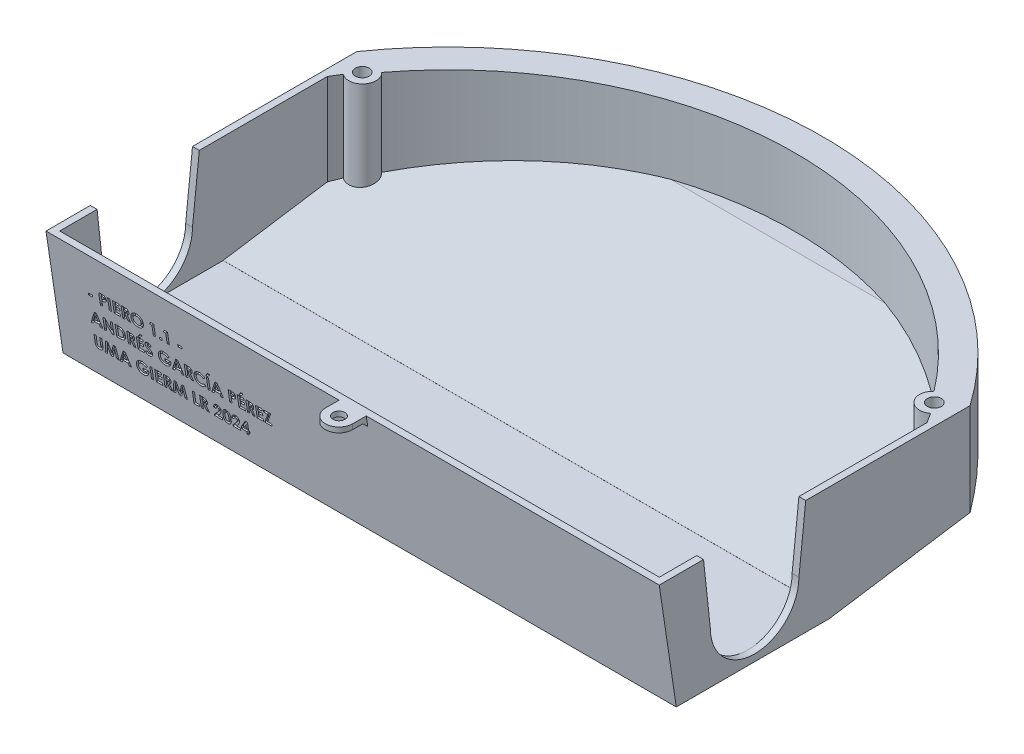
from build123d import *

# Parameters (mm, degrees)
SALIENTE_EXTRUIR1_DEPTH = 90
CROQUIS4_W              = 2
CROQUIS4_H              = 47.977846023
SALIENTE_EXTRUIR2_DEPTH = 31.5
CORTAR_EXTRUIR1_DEPTH   = 186.21946442
SALIENTE_EXTRUIR4_DEPTH = 90
CROQUIS15_R             = 150
CROQUIS15_R_2           = 110
CORTAR_EXTRUIR3_DEPTH   = 147.021402541
SALIENTE_EXTRUIR5_REACH = 148.021
CROQUIS16_R             = 1.75
SALIENTE_EXTRUIR6_DEPTH = 1.5
CROQUIS17_R             = 2.05
CORTAR_EXTRUIR4_DEPTH   = 5.2
SALIENTE_EXTRUIR7_DEPTH = 4
CROQUIS19_W             = 1.211538462
CROQUIS19_H             = 0.583333333
CROQUIS19_W_2           = 0.628205128
CROQUIS19_H_2           = 3.5
CORTAR_EXTRUIR5_DEPTH   = 0.6


with BuildPart() as part:
    # Croquis3 → Saliente-Extruir1 (new, symmetric)
    with BuildSketch(Plane(origin=(0, 0, 0), x_dir=(0, 0, -1), z_dir=(1, 0, 0))):
        Polygon((-28, 0), (-23, -33.5), (22, -33.5), (22, -31.5), (-21.276353486, -31.5), (-25.977846023, 0), align=None)
    extrude(amount=SALIENTE_EXTRUIR1_DEPTH, both=True)

    # Croquis4 → Saliente-Extruir2 (add, through all)
    with BuildSketch(Plane(origin=(0, -31.5, 0), x_dir=(1, 0, 0), z_dir=(0, 1, 0))):
        with Locations((-89, -1.988923012)):
            Rectangle(CROQUIS4_W, CROQUIS4_H)
        with Locations((89, -1.988923012)):
            Rectangle(CROQUIS4_W, CROQUIS4_H)
    extrude(amount=SALIENTE_EXTRUIR2_DEPTH)

    # Croquis5 → Cortar-Extruir1 (cut, through all)
    with BuildSketch(Plane.ZY.offset(90)):
        Polygon((25.977846023, -31.5), (25.977846023, -13.548431644), (23.298507463, -31.5), align=None)
        with BuildLine():
            Line((-13, -18.5), (-15, 0))
            Line((-15, 0), (15, 0))
            Line((15, 0), (13, -18.5))
            ThreePointArc((13, -18.5), (0, -31.5), (-13, -18.5))
        make_face()
    extrude(amount=-CORTAR_EXTRUIR1_DEPTH, mode=Mode.SUBTRACT)

    # Croquis12 → Saliente-Extruir4 (add, symmetric)
    with BuildSketch(Plane(origin=(0, 0, 0), x_dir=(0, 0, -1), z_dir=(1, 0, 0))):
        Polygon((22, -33.5), (110, -20), (96.810446001, -20), (22, -31.476602511), align=None)
    extrude(amount=SALIENTE_EXTRUIR4_DEPTH, both=True)

    # Croquis15 → Cortar-Extruir3 (cut, through all)
    with BuildSketch(Plane(origin=(0, 0, 0), x_dir=(1, 0, 0), z_dir=(0, 1, 0))):
        Circle(CROQUIS15_R)
        Circle(CROQUIS15_R_2, mode=Mode.SUBTRACT)
    extrude(amount=-CORTAR_EXTRUIR3_DEPTH, mode=Mode.SUBTRACT)

    # Croquis13 → Saliente-Extruir5 (add, up to next)
    with BuildSketch(Plane(origin=(0, 0, 0), x_dir=(1, 0, 0), z_dir=(0, 1, 0)), mode=Mode.PRIVATE) as saliente_extruir5_sk1:
        with BuildLine():
            Line((90, 22), (88, 22))
            Line((88, 22), (88, 52.557111793))
            ThreePointArc((88, 52.557111793), (87.108021373, 54.022612048), (86.191639509, 55.472977915))
            ThreePointArc((86.191639509, 55.472977915), (80.701787493, 56.082409886), (81.054916962, 61.594685465))
            ThreePointArc((81.054916962, 61.594685465), (0, 101.802774231), (-81.054916962, 61.594685465))
            ThreePointArc((-81.054916962, 61.594685465), (-80.701787493, 56.082409886), (-86.191639509, 55.472977915))
            ThreePointArc((-86.191639509, 55.472977915), (-87.108021373, 54.022612048), (-88, 52.557111793))
            Line((-88, 52.557111793), (-88, 22))
            Line((-88, 22), (-90, 22))
            Line((-90, 22), (-90, 63.245553203))
            ThreePointArc((-90, 63.245553203), (0, 110), (90, 63.245553203))
            Line((90, 63.245553203), (90, 22))
        make_face()
    saliente_extruir5_tool1 = extrude(saliente_extruir5_sk1.sketch, amount=-SALIENTE_EXTRUIR5_REACH, mode=Mode.PRIVATE) - part.part
    add(saliente_extruir5_tool1.solids().sort_by_distance((89.79964, 0, -42.622777))[0])

    # Croquis17 → Cortar-Extruir4 (cut)
    with BuildSketch(Plane(origin=(0, 0, 0), x_dir=(1, 0, 0), z_dir=(0, 1, 0))):
        with Locations(Location((-83.96308454, 58.791584726, 0), (0, 0, 270))):
            Circle(CROQUIS17_R)
        with Locations(Location((83.96308454, 58.791584726, 0), (0, 0, 90))):
            Circle(CROQUIS17_R)
    extrude(amount=-CORTAR_EXTRUIR4_DEPTH, mode=Mode.SUBTRACT)



with BuildPart() as body_2:
    # Croquis16 → Saliente-Extruir6 (new body)
    with BuildSketch(Plane(origin=(0, 0, 0), x_dir=(1, 0, 0), z_dir=(0, 1, 0))):
        with BuildLine():
            Line((-4, -28), (4, -28))
            Line((4, -28), (4, -32))
            ThreePointArc((4, -32), (0, -36), (-4, -32))
            Line((-4, -32), (-4, -28))
        make_face()
        with Locations(Location((0, -32, 0), (0, 0, 270))):
            Circle(CROQUIS16_R, mode=Mode.SUBTRACT)
    extrude(amount=-SALIENTE_EXTRUIR6_DEPTH)


with BuildPart() as part_1:
    add(part.part)

    add(body_2.part)  # Saliente-Extruir7 merges body 2
    # Croquis18 → Saliente-Extruir7 (add, symmetric)
    with BuildSketch(Plane(origin=(0, 0, 0), x_dir=(0, 0, -1), z_dir=(1, 0, 0))):
        Polygon((-28, -1.5), (-28, 0), (-27.561403509, -2.938596491), (-29, -1.5), align=None)
    extrude(amount=SALIENTE_EXTRUIR7_DEPTH, both=True)

    # Croquis19 → Cortar-Extruir5 (cut)
    # profile 1 of 44: a face of its own
    with BuildSketch(Plane(origin=(0, -4.088036609, 27.389845282), x_dir=(1, 0, 0), z_dir=(0, -0.14761856225269074, 0.9890443670930281))):
        with Locations((-78.668957678, -7.473571481)):
            Rectangle(CROQUIS19_W, CROQUIS19_H)
    # profile 2 of 44: a face of its own
    with BuildSketch(Plane(origin=(0, -4.088036609, 27.389845282), x_dir=(1, 0, 0), z_dir=(0, -0.14761856225269074, 0.9890443670930281))):
        with BuildLine():
            Line((-75.909342294, -5.252417635), (-75.208220499, -5.252417635))
            add(Edge.make_bspline(
                [(-75.208220499, -5.252417635), (-75.16241011, -5.252622692), (-75.074032268, -5.25301829), (-74.946584149, -5.257815442), (-74.829007019, -5.266412231), (-74.721327891, -5.277036503), (-74.62359104, -5.291931319), (-74.535674071, -5.309007059), (-74.457558738, -5.329810281), (-74.388364175, -5.354503416), (-74.326264289, -5.383615658), (-74.267497769, -5.414622273), (-74.213392743, -5.451627576), (-74.161218367, -5.49064329), (-74.113957542, -5.535396573), (-74.068661852, -5.582909028), (-74.027249694, -5.635064961), (-73.989529181, -5.691233038), (-73.955310863, -5.750375513), (-73.925415451, -5.812598115), (-73.901165967, -5.877999305), (-73.880823665, -5.946156011), (-73.86448453, -6.017065264), (-73.853608681, -6.091163161), (-73.846221258, -6.167932323), (-73.84556942, -6.220181463), (-73.84523973, -6.24660834)],
                knots=[0, 0, 0, 0, 1.698747864, 3.27724071, 4.728299578, 6.070144658, 7.288476769, 8.393259625, 9.389771311, 10.283485332, 11.113357557, 11.931608583, 12.74405601, 13.541433047, 14.344816069, 15.154114104, 15.974336324, 16.810834471, 17.661136416, 18.50621059, 19.367396281, 20.244825668, 21.142564693, 22.063065223, 23.020325768, 24, 24, 24, 24], degree=3))
            add(Edge.make_bspline(
                [(-73.84523973, -6.24660834), (-73.84571675, -6.275843764), (-73.846654155, -6.333294965), (-73.855843741, -6.417511378), (-73.871542458, -6.497804103), (-73.89205986, -6.574850262), (-73.920669918, -6.647382276), (-73.953355565, -6.717130782), (-73.993569279, -6.782140244), (-74.039519876, -6.843223853), (-74.08970317, -6.900878248), (-74.14531051, -6.953438766), (-74.205281997, -7.001263712), (-74.269270477, -7.044854294), (-74.337516182, -7.084122581), (-74.40996987, -7.119436277), (-74.487126295, -7.149665943), (-74.540855708, -7.165475813), (-74.5680963, -7.173491353)],
                knots=[0, 0, 0, 0, 1.102006807, 2.165578795, 3.188629044, 4.184801286, 5.166646146, 6.124351954, 7.085497154, 8.042432466, 9.003981491, 9.963833307, 10.922997304, 11.89326795, 12.880200226, 13.889073926, 14.929769137, 16, 16, 16, 16], degree=3))
            add(Edge.make_bspline(
                [(-74.5680963, -7.173491353), (-74.586038521, -7.177955406), (-74.624907149, -7.187625984), (-74.689224053, -7.197444047), (-74.763342532, -7.206471153), (-74.847502259, -7.214228858), (-74.941751755, -7.219502289), (-75.045999761, -7.223620604), (-75.160293521, -7.226615045), (-75.239768882, -7.226721301), (-75.281137165, -7.226776609)],
                knots=[0, 0, 0, 0, 0.618981996, 1.340914327, 2.176866532, 3.120127938, 4.170906482, 5.338178032, 6.614476169, 8, 8, 8, 8], degree=3))
            Line((-75.281137165, -7.226776609), (-75.281137165, -8.752417635))
            Line((-75.281137165, -8.752417635), (-75.909342294, -8.752417635))
            Line((-75.909342294, -8.752417635), (-75.909342294, -5.252417635))
        make_face()
        with BuildLine():
            Line((-75.281137165, -6.598571481), (-75.058881556, -6.598571481))
            add(Edge.make_bspline(
                [(-75.058881556, -6.598571481), (-75.018438639, -6.598315041), (-74.944023071, -6.597843189), (-74.842397684, -6.591019928), (-74.760729568, -6.58059943), (-74.69621024, -6.565654027), (-74.645266119, -6.542972398), (-74.601330004, -6.516734025), (-74.563644877, -6.483556323), (-74.531015103, -6.445645121), (-74.504928583, -6.402083249), (-74.48683894, -6.353580029), (-74.475088263, -6.301154565), (-74.474002979, -6.264669912), (-74.473444858, -6.245907218)],
                knots=[0, 0, 0, 0, 1.8619151, 3.425951444, 4.686033666, 5.651700536, 6.461346321, 7.243864085, 7.999046032, 8.762387399, 9.539336099, 10.322741239, 11.137448474, 12, 12, 12, 12], degree=3))
            add(Edge.make_bspline(
                [(-74.473444858, -6.245907218), (-74.473997238, -6.229514496), (-74.475068988, -6.197708675), (-74.482942356, -6.151804986), (-74.49549024, -6.109013278), (-74.513671641, -6.069780455), (-74.537175888, -6.034173178), (-74.565832321, -6.002205475), (-74.599273222, -5.973192731), (-74.625091554, -5.957835842), (-74.63820848, -5.95003382)],
                knots=[0, 0, 0, 0, 1.102301479, 2.1387299, 3.123554645, 4.094223062, 5.036071848, 5.982632524, 6.975082478, 8, 8, 8, 8], degree=3))
            add(Edge.make_bspline(
                [(-74.63820848, -5.95003382), (-74.649319273, -5.944414774), (-74.6728431, -5.9325181), (-74.712906457, -5.918687347), (-74.75913896, -5.907019583), (-74.811852729, -5.897335452), (-74.870837475, -5.88981956), (-74.936082674, -5.884071783), (-75.007684339, -5.881760378), (-75.057479013, -5.881012427), (-75.083420819, -5.880622763)],
                knots=[0, 0, 0, 0, 0.656809284, 1.390599849, 2.23162475, 3.173112763, 4.218524733, 5.370385145, 6.63003504, 8, 8, 8, 8], degree=3))
            Line((-75.083420819, -5.880622763), (-75.281137165, -5.880622763))
            Line((-75.281137165, -5.880622763), (-75.281137165, -6.598571481))
        make_face(mode=Mode.SUBTRACT)
    # profile 3 of 44: a face of its own
    with BuildSketch(Plane(origin=(0, -4.088036609, 27.389845282), x_dir=(1, 0, 0), z_dir=(0, -0.14761856225269074, 0.9890443670930281))):
        with Locations((-72.992675627, -7.002417635)):
            Rectangle(CROQUIS19_W_2, CROQUIS19_H_2)
    # profile 4 of 44: a face of its own
    with BuildSketch(Plane(origin=(0, -4.088036609, 27.389845282), x_dir=(1, 0, 0), z_dir=(0, -0.14761856225269074, 0.9890443670930281))):
        Polygon((-71.870880755, -5.252417635), (-69.986265371, -5.252417635), (-69.986265371, -5.880622763), (-71.242675627, -5.880622763), (-71.242675627, -6.553699686), (-69.986265371, -6.553699686), (-69.986265371, -7.181904814), (-71.242675627, -7.181904814), (-71.242675627, -8.124212506), (-69.986265371, -8.124212506), (-69.986265371, -8.752417635), (-71.870880755, -8.752417635), align=None)
    # profile 5 of 44: a face of its own
    with BuildSketch(Plane(origin=(0, -4.088036609, 27.389845282), x_dir=(1, 0, 0), z_dir=(0, -0.14761856225269074, 0.9890443670930281))):
        with BuildLine():
            Line((-69.358060242, -5.252417635), (-68.626089088, -5.252417635))
            add(Edge.make_bspline(
                [(-68.626089088, -5.252417635), (-68.577706018, -5.252589367), (-68.484651745, -5.252919656), (-68.350472565, -5.258130746), (-68.227210536, -5.265382405), (-68.114683157, -5.276448629), (-68.012938569, -5.291121104), (-67.9218748, -5.308417525), (-67.841494511, -5.328130505), (-67.771119807, -5.352694433), (-67.707610117, -5.380402171), (-67.648410256, -5.412238871), (-67.592214187, -5.44785002), (-67.539397521, -5.488172644), (-67.489501268, -5.532481348), (-67.442431296, -5.580820736), (-67.398852747, -5.633600703), (-67.359035462, -5.690487748), (-67.322745211, -5.750331614), (-67.290672241, -5.813214469), (-67.264590449, -5.879180042), (-67.241544389, -5.947274989), (-67.224945059, -6.01847274), (-67.213400468, -6.092080173), (-67.204947969, -6.168356395), (-67.204461991, -6.220175073), (-67.204214088, -6.24660834)],
                knots=[0, 0, 0, 0, 1.749336639, 3.364467119, 4.854658419, 6.213483162, 7.451590619, 8.570285859, 9.5643256, 10.440900261, 11.26203566, 12.067320669, 12.869050712, 13.665104639, 14.467235401, 15.27997916, 16.102287765, 16.939272006, 17.78853747, 18.631303466, 19.488103222, 20.351255419, 21.228522269, 22.127379805, 23.044756219, 24, 24, 24, 24], degree=3))
            add(Edge.make_bspline(
                [(-67.204214088, -6.24660834), (-67.204858051, -6.274198598), (-67.206120743, -6.328298067), (-67.212922292, -6.407765774), (-67.225353386, -6.483794917), (-67.244182086, -6.556162893), (-67.265823232, -6.625770406), (-67.294600405, -6.691333152), (-67.327078288, -6.753804648), (-67.365651321, -6.812301211), (-67.407983341, -6.868122165), (-67.457214589, -6.919128804), (-67.510155637, -6.96806254), (-67.569782494, -7.011858331), (-67.633466754, -7.05347749), (-67.702473754, -7.091195531), (-67.776353132, -7.1259606), (-67.828293994, -7.145348004), (-67.854855114, -7.155262186)],
                knots=[0, 0, 0, 0, 1.099860209, 2.156625411, 3.176576793, 4.16617041, 5.135385252, 6.078461593, 7.016046972, 7.938469504, 8.868247731, 9.803980173, 10.76021508, 11.73834243, 12.748633912, 13.790971185, 14.870363756, 16, 16, 16, 16], degree=3))
            Line((-67.854855114, -7.155262186), (-67.047162806, -8.752417635))
            Line((-67.047162806, -8.752417635), (-67.745480114, -8.752417635))
            Line((-67.745480114, -8.752417635), (-68.516714088, -7.226776609))
            Line((-68.516714088, -7.226776609), (-68.729855114, -7.226776609))
            Line((-68.729855114, -7.226776609), (-68.729855114, -8.752417635))
            Line((-68.729855114, -8.752417635), (-69.358060242, -8.752417635))
            Line((-69.358060242, -8.752417635), (-69.358060242, -5.252417635))
        make_face()
        with BuildLine():
            Line((-68.729855114, -6.598571481), (-68.485163608, -6.598571481))
            add(Edge.make_bspline(
                [(-68.485163608, -6.598571481), (-68.455248037, -6.598234551), (-68.397966147, -6.597589404), (-68.315587266, -6.594596944), (-68.240767596, -6.587386595), (-68.173185836, -6.578276588), (-68.11250192, -6.567757769), (-68.059257128, -6.552683663), (-68.012631038, -6.536531376), (-67.973176172, -6.516458274), (-67.939466841, -6.493630803), (-67.910360992, -6.467698229), (-67.886286281, -6.437684577), (-67.866471566, -6.404405487), (-67.851057872, -6.367566616), (-67.839807056, -6.32757237), (-67.833519513, -6.283967163), (-67.83279611, -6.253873633), (-67.832419217, -6.238194878)],
                knots=[0, 0, 0, 0, 1.688639943, 3.233382647, 4.650958383, 5.928841754, 7.082724185, 8.122798841, 9.049171256, 9.863274652, 10.613301712, 11.341792392, 12.054588806, 12.776240173, 13.521029143, 14.301969904, 15.115324896, 16, 16, 16, 16], degree=3))
            add(Edge.make_bspline(
                [(-67.832419217, -6.238194878), (-67.833131769, -6.219645767), (-67.834531445, -6.183209476), (-67.848420582, -6.130753992), (-67.870529089, -6.082202853), (-67.900833796, -6.037775425), (-67.938998635, -5.998827274), (-67.982795799, -5.964494169), (-68.033170536, -5.937346119), (-68.079813752, -5.919439554), (-68.122248176, -5.908725871), (-68.160543905, -5.90074213), (-68.20489059, -5.895083823), (-68.255321709, -5.889082181), (-68.311708713, -5.885190421), (-68.374358945, -5.882350211), (-68.443092472, -5.881188142), (-68.491006269, -5.880816649), (-68.516012967, -5.880622763)],
                knots=[0, 0, 0, 0, 1.020303359, 2.004196876, 2.966617323, 3.9489082, 4.950758222, 5.960522915, 7.003732012, 8.091992268, 8.70421221, 9.413913587, 10.24622431, 11.166358409, 12.212345909, 13.359657661, 14.621978493, 16, 16, 16, 16], degree=3))
            Line((-68.516012967, -5.880622763), (-68.729855114, -5.880622763))
            Line((-68.729855114, -5.880622763), (-68.729855114, -6.598571481))
        make_face(mode=Mode.SUBTRACT)
    # profile 6 of 44: a face of its own
    with BuildSketch(Plane(origin=(0, -4.088036609, 27.389845282), x_dir=(1, 0, 0), z_dir=(0, -0.14761856225269074, 0.9890443670930281))):
        with BuildLine():
            add(Edge.make_bspline(
                [(-64.886305435, -5.162674045), (-64.825453645, -5.164249607), (-64.70531843, -5.167360122), (-64.528642881, -5.1932887), (-64.358383322, -5.235535599), (-64.194616745, -5.294261845), (-64.037753201, -5.371058043), (-63.887239381, -5.46374697), (-63.743614418, -5.574078073), (-63.608350066, -5.699477512), (-63.483341409, -5.835843925), (-63.375021335, -5.982666613), (-63.282649949, -6.136141253), (-63.206092298, -6.296679083), (-63.147779396, -6.465391906), (-63.106858822, -6.641419508), (-63.08056938, -6.824711812), (-63.077545689, -6.949508888), (-63.07600896, -7.012934462)],
                knots=[0, 0, 0, 0, 1.014329547, 2.002516266, 2.970391464, 3.935626869, 4.897733899, 5.877609409, 6.878433252, 7.912639331, 8.949961323, 9.958554974, 10.949718813, 11.932905612, 12.9188844, 13.919928257, 14.942845884, 16, 16, 16, 16], degree=3))
            add(Edge.make_bspline(
                [(-63.07600896, -7.012934462), (-63.07764551, -7.075645375), (-63.080870384, -7.199219242), (-63.105785572, -7.380822435), (-63.147395254, -7.554964415), (-63.204719123, -7.722039357), (-63.279888308, -7.881238005), (-63.370458351, -8.033576823), (-63.478819223, -8.177642068), (-63.601018577, -8.313356431), (-63.735549462, -8.436546336), (-63.878039025, -8.545107228), (-64.027829338, -8.63709763), (-64.184701156, -8.712475408), (-64.348990882, -8.770973325), (-64.520292702, -8.812247856), (-64.698596014, -8.837331222), (-64.819850914, -8.840535032), (-64.881397582, -8.842161224)],
                knots=[0, 0, 0, 0, 1.051557043, 2.072126891, 3.067553643, 4.050577992, 5.02905126, 6.015227836, 7.017913613, 8.04756643, 9.074058332, 10.072836633, 11.047628519, 12.017157415, 12.98668631, 13.966869689, 14.968021931, 16, 16, 16, 16], degree=3))
            add(Edge.make_bspline(
                [(-64.881397582, -8.842161224), (-64.945768017, -8.840702449), (-65.072247124, -8.837836156), (-65.257349863, -8.810579017), (-65.434694281, -8.769520244), (-65.602790583, -8.708242227), (-65.763350686, -8.631639553), (-65.915194908, -8.537298768), (-66.058272219, -8.425375777), (-66.191761905, -8.298736969), (-66.312703883, -8.160166337), (-66.419458902, -8.013778752), (-66.509509128, -7.860692488), (-66.582857857, -7.700835895), (-66.640683049, -7.535202446), (-66.681472151, -7.362783382), (-66.705567248, -7.183992229), (-66.708923555, -7.062553704), (-66.710624345, -7.001015391)],
                knots=[0, 0, 0, 0, 1.067978421, 2.098431617, 3.099715153, 4.085208694, 5.062210972, 6.048429807, 7.046490867, 8.072918869, 9.098532598, 10.095778865, 11.076610158, 12.041847152, 13.011192615, 13.984257998, 14.978533688, 16, 16, 16, 16], degree=3))
            add(Edge.make_bspline(
                [(-66.710624345, -7.001015391), (-66.710090539, -6.959615635), (-66.709029686, -6.87734034), (-66.696250597, -6.755412553), (-66.677852383, -6.635864632), (-66.650642297, -6.519173217), (-66.617588998, -6.404515104), (-66.574763779, -6.29295756), (-66.52601709, -6.183308843), (-66.469061174, -6.076864042), (-66.405731703, -5.974602537), (-66.336633612, -5.877006715), (-66.261593154, -5.785256651), (-66.18085206, -5.698749402), (-66.094132084, -5.618053586), (-66.00257394, -5.542026842), (-65.904401931, -5.47268871), (-65.801764735, -5.408345814), (-65.695240997, -5.35016165), (-65.585264365, -5.300637029), (-65.474100575, -5.257388022), (-65.360264629, -5.223253993), (-65.244976481, -5.195452183), (-65.127004511, -5.177066369), (-65.007414529, -5.164287634), (-64.926770938, -5.163213184), (-64.886305435, -5.162674045)],
                knots=[0, 0, 0, 0, 1.034744296, 2.056386356, 3.06226378, 4.057406941, 5.050368692, 6.043467995, 7.042652155, 8.049140477, 9.059438543, 10.048523776, 11.036952808, 12.020949711, 13.004946614, 13.997082645, 14.994316842, 16.007702937, 17.024872941, 18.026463647, 19.021641123, 20.005082605, 20.995858141, 21.984425357, 22.988620895, 24, 24, 24, 24], degree=3))
        make_face()
        with BuildLine():
            add(Edge.make_bspline(
                [(-64.89612114, -5.790879173), (-64.937074386, -5.791978041), (-65.017899706, -5.794146765), (-65.136455731, -5.810669515), (-65.250273702, -5.837058225), (-65.358722681, -5.875281948), (-65.462272694, -5.923931046), (-65.561107305, -5.982835534), (-65.653857858, -6.054020187), (-65.741761093, -6.133663419), (-65.8211672, -6.222404282), (-65.891325001, -6.317505209), (-65.95003578, -6.418807383), (-65.999206426, -6.52536973), (-66.036221024, -6.638390517), (-66.062585412, -6.756984437), (-66.079246722, -6.881355836), (-66.081346901, -6.966139657), (-66.082419217, -7.009428853)],
                knots=[0, 0, 0, 0, 1.033739768, 2.040188636, 3.016340934, 3.979330865, 4.937572243, 5.900995986, 6.878200029, 7.884839167, 8.891893314, 9.879764717, 10.863503415, 11.843163062, 12.837761627, 13.859916423, 14.907309254, 16, 16, 16, 16], degree=3))
            add(Edge.make_bspline(
                [(-66.082419217, -7.009428853), (-66.080997489, -7.057403019), (-66.078211139, -7.151424436), (-66.058606042, -7.288580346), (-66.025063672, -7.418110491), (-65.976629142, -7.539381357), (-65.916557617, -7.653739567), (-65.841958318, -7.759783498), (-65.754039399, -7.858148092), (-65.686307377, -7.91557744), (-65.651930435, -7.944725327)],
                knots=[0, 0, 0, 0, 1.078454662, 2.113592447, 3.107694534, 4.079536787, 5.043276885, 6.005368276, 6.987637804, 8, 8, 8, 8], degree=3))
            add(Edge.make_bspline(
                [(-65.651930435, -7.944725327), (-65.623769156, -7.966258666), (-65.568081077, -8.008840195), (-65.47919078, -8.06341716), (-65.387651276, -8.110195064), (-65.292771787, -8.147991056), (-65.194752692, -8.177720749), (-65.093607434, -8.198539963), (-64.989479325, -8.211605821), (-64.919063019, -8.213167439), (-64.883500947, -8.213956096)],
                knots=[0, 0, 0, 0, 1.023928204, 2.024787132, 3.009472467, 3.9914905, 4.972207045, 5.96565515, 6.972602802, 8, 8, 8, 8], degree=3))
            add(Edge.make_bspline(
                [(-64.883500947, -8.213956096), (-64.843251893, -8.212847911), (-64.764060613, -8.210667523), (-64.647711573, -8.194348177), (-64.536245658, -8.166729952), (-64.428970879, -8.128841541), (-64.326196569, -8.079581611), (-64.228425014, -8.018850091), (-64.135484793, -7.947392685), (-64.047693546, -7.866703563), (-63.967448197, -7.777613122), (-63.897436801, -7.682004937), (-63.836859312, -7.581985541), (-63.788711171, -7.476139313), (-63.75023421, -7.36546539), (-63.72418713, -7.249473622), (-63.707385071, -7.128642172), (-63.7052843, -7.046412099), (-63.704214088, -7.004521)],
                knots=[0, 0, 0, 0, 1.026359118, 2.019393844, 2.989460624, 3.950973911, 4.916101784, 5.890408035, 6.881132271, 7.902007068, 8.92769091, 9.933912415, 10.920395702, 11.90457117, 12.894218921, 13.903490204, 14.931958862, 16, 16, 16, 16], degree=3))
            add(Edge.make_bspline(
                [(-63.704214088, -7.004521), (-63.70532133, -6.962870786), (-63.707500765, -6.880888692), (-63.723848834, -6.760367898), (-63.751291911, -6.6448882), (-63.789294097, -6.534261007), (-63.837820877, -6.428377864), (-63.897829162, -6.327611118), (-63.969108392, -6.232058186), (-64.05001808, -6.142370225), (-64.138083302, -6.059952733), (-64.232630118, -5.988429333), (-64.331013, -5.926277772), (-64.435489333, -5.877590748), (-64.543921619, -5.8388019), (-64.656971516, -5.810237236), (-64.775067208, -5.794262839), (-64.85541015, -5.792017115), (-64.89612114, -5.790879173)],
                knots=[0, 0, 0, 0, 1.055025985, 2.07665775, 3.074803781, 4.057872707, 5.035505728, 6.020516407, 7.023567878, 8.050795229, 9.077271434, 10.074415901, 11.050397877, 12.019801805, 12.988065821, 13.964604439, 14.968634123, 16, 16, 16, 16], degree=3))
        make_face(mode=Mode.SUBTRACT)
    # profile 7 of 44: a face of its own
    with BuildSketch(Plane(origin=(0, -4.088036609, 27.389845282), x_dir=(1, 0, 0), z_dir=(0, -0.14761856225269074, 0.9890443670930281))):
        Polygon((-60.726549826, -5.252417635), (-59.75549614, -5.252417635), (-59.75549614, -8.752417635), (-60.383701268, -8.752417635), (-60.383701268, -5.835750968), (-61.101649986, -5.835750968), align=None)
    # profile 8 of 44: a face of its own
    with BuildSketch(Plane(origin=(0, -4.088036609, 27.389845282), x_dir=(1, 0, 0), z_dir=(0, -0.14761856225269074, 0.9890443670930281))):
        with BuildLine():
            add(Edge.make_bspline(
                [(-58.162547422, -8.034468917), (-58.137187526, -8.035859339), (-58.08725827, -8.03859684), (-58.015117303, -8.059026525), (-57.950009665, -8.095731363), (-57.891794738, -8.143606464), (-57.842569661, -8.201206602), (-57.806990888, -8.266892517), (-57.784835094, -8.338755515), (-57.782389079, -8.388841854), (-57.781137165, -8.414476929)],
                knots=[0, 0, 0, 0, 1.016957001, 2.002212695, 2.9757545, 3.99499976, 5.013036768, 5.994806404, 6.97370641, 8, 8, 8, 8], degree=3))
            add(Edge.make_bspline(
                [(-57.781137165, -8.414476929), (-57.782380878, -8.440116122), (-57.784810869, -8.490210505), (-57.807144204, -8.562213533), (-57.842516495, -8.628439326), (-57.891798687, -8.686656688), (-57.949768577, -8.73543404), (-58.015266997, -8.771800406), (-58.087120843, -8.793389015), (-58.137163337, -8.795976783), (-58.162547422, -8.797289429)],
                knots=[0, 0, 0, 0, 1.023218912, 1.999186227, 2.986238111, 4.008388923, 5.030539734, 6.0011649, 6.986089706, 8, 8, 8, 8], degree=3))
            add(Edge.make_bspline(
                [(-58.162547422, -8.797289429), (-58.187937521, -8.795987457), (-58.237991873, -8.793420732), (-58.309957411, -8.771618436), (-58.375939391, -8.735676836), (-58.433923846, -8.686597521), (-58.483426209, -8.628645479), (-58.517792833, -8.562004579), (-58.540334196, -8.490237651), (-58.542730968, -8.440125312), (-58.543957678, -8.414476929)],
                knots=[0, 0, 0, 0, 1.013427518, 1.99788335, 2.976245624, 3.997909735, 5.019573847, 6.001765691, 6.977268297, 8, 8, 8, 8], degree=3))
            add(Edge.make_bspline(
                [(-58.543957678, -8.414476929), (-58.542722875, -8.388832504), (-58.540310291, -8.338727896), (-58.517945712, -8.267103878), (-58.483371131, -8.200999329), (-58.433927974, -8.143665754), (-58.375697061, -8.095490463), (-58.310107944, -8.059206002), (-58.237854515, -8.038564889), (-58.187913361, -8.035848577), (-58.162547422, -8.034468917)],
                knots=[0, 0, 0, 0, 1.025808215, 2.00424526, 2.981110158, 3.998665696, 5.017428914, 5.998734231, 6.983523959, 8, 8, 8, 8], degree=3))
        make_face()
    # profile 9 of 44: a face of its own
    with BuildSketch(Plane(origin=(0, -4.088036609, 27.389845282), x_dir=(1, 0, 0), z_dir=(0, -0.14761856225269074, 0.9890443670930281))):
        Polygon((-56.688088287, -5.252417635), (-55.717034601, -5.252417635), (-55.717034601, -8.752417635), (-56.34523973, -8.752417635), (-56.34523973, -5.835750968), (-57.063188447, -5.835750968), align=None)
    # profile 10 of 44: a face of its own
    with BuildSketch(Plane(origin=(0, -4.088036609, 27.389845282), x_dir=(1, 0, 0), z_dir=(0, -0.14761856225269074, 0.9890443670930281))):
        with Locations((-52.418957678, -7.473571481)):
            Rectangle(CROQUIS19_W, CROQUIS19_H)
    # profile 11 of 44: a face of its own
    with BuildSketch(Plane(origin=(0, -4.088036609, 27.389845282), x_dir=(1, 0, 0), z_dir=(0, -0.14761856225269074, 0.9890443670930281))):
        Polygon((-78.19710271, -11.951135583), (-77.614470499, -11.951135583), (-76.20100896, -15.451135583), (-76.871982518, -15.451135583), (-77.144017774, -14.733186865), (-78.668957678, -14.733186865), (-78.940992935, -15.451135583), (-79.611265371, -15.451135583), align=None)
        Polygon((-77.906137165, -12.889937667), (-78.430576268, -14.104981737), (-77.381698063, -14.104981737), align=None, mode=Mode.SUBTRACT)
    # profile 12 of 44: a face of its own
    with BuildSketch(Plane(origin=(0, -4.088036609, 27.389845282), x_dir=(1, 0, 0), z_dir=(0, -0.14761856225269074, 0.9890443670930281))):
        Polygon((-75.684983319, -11.951135583), (-75.119178031, -11.951135583), (-73.531137165, -14.254320679), (-73.531137165, -11.951135583), (-72.902932037, -11.951135583), (-72.902932037, -15.451135583), (-73.472944056, -15.451135583), (-75.056778191, -13.154961705), (-75.056778191, -15.451135583), (-75.684983319, -15.451135583), align=None)
    # profile 13 of 44: a face of its own
    with BuildSketch(Plane(origin=(0, -4.088036609, 27.389845282), x_dir=(1, 0, 0), z_dir=(0, -0.14761856225269074, 0.9890443670930281))):
        with BuildLine():
            Line((-72.09523973, -11.951135583), (-71.303673223, -11.951135583))
            add(Edge.make_bspline(
                [(-71.303673223, -11.951135583), (-71.241961509, -11.951566969), (-71.122672069, -11.952400843), (-70.949845269, -11.961796598), (-70.789138338, -11.976246602), (-70.64044768, -11.996125201), (-70.504078136, -12.022430031), (-70.380205552, -12.055424285), (-70.268414181, -12.093510662), (-70.167478254, -12.138327013), (-70.07533346, -12.190578427), (-69.987839038, -12.248782308), (-69.905166781, -12.315070833), (-69.826156514, -12.388165165), (-69.751827881, -12.469402542), (-69.680943044, -12.557437379), (-69.615237586, -12.653546303), (-69.552725373, -12.755424924), (-69.496191395, -12.863504994), (-69.446880346, -12.976866559), (-69.405572182, -13.094780094), (-69.37200716, -13.217371265), (-69.345251963, -13.344233106), (-69.326531891, -13.475621613), (-69.314958956, -13.611415141), (-69.313784978, -13.703449083), (-69.313188447, -13.750214109)],
                knots=[0, 0, 0, 0, 1.44355588, 2.790409838, 4.047694926, 5.217575253, 6.298404546, 7.294384826, 8.214239204, 9.058592145, 9.873746385, 10.689560431, 11.514393297, 12.350027578, 13.205127629, 14.088021785, 14.991911688, 15.926770944, 16.882954281, 17.842803888, 18.816321264, 19.80318086, 20.814351908, 21.847355356, 22.906180909, 24, 24, 24, 24], degree=3))
            add(Edge.make_bspline(
                [(-69.313188447, -13.750214109), (-69.314750487, -13.816202604), (-69.317825454, -13.94610482), (-69.343727258, -14.136734826), (-69.385619245, -14.319472699), (-69.444523183, -14.492888994), (-69.517548298, -14.655439413), (-69.604784975, -14.804257446), (-69.704954122, -14.938544316), (-69.816888761, -15.057631382), (-69.938086714, -15.159988329), (-70.064035827, -15.247649564), (-70.195963073, -15.316777763), (-70.312209415, -15.360615378), (-70.413009496, -15.387878582), (-70.501510876, -15.403991398), (-70.602039414, -15.418767822), (-70.715532451, -15.430186725), (-70.841492117, -15.44036958), (-70.98042049, -15.445902547), (-71.131867759, -15.450499622), (-71.237062207, -15.450918041), (-71.291754153, -15.451135583)],
                knots=[0, 0, 0, 0, 1.315458931, 2.589557908, 3.828601765, 5.048913369, 6.235739168, 7.376350998, 8.481830359, 9.569842114, 10.627874879, 11.640079404, 12.624025415, 13.590060155, 14.111227486, 14.704434459, 15.382649715, 16.137166398, 16.978595427, 17.902333227, 18.909396075, 20, 20, 20, 20], degree=3))
            Line((-71.291754153, -15.451135583), (-72.09523973, -15.451135583))
            Line((-72.09523973, -15.451135583), (-72.09523973, -11.951135583))
        make_face()
        with BuildLine():
            Line((-71.467034601, -12.579340712), (-71.467034601, -14.822930455))
            Line((-71.467034601, -14.822930455), (-71.138909601, -14.822930455))
            add(Edge.make_bspline(
                [(-71.138909601, -14.822930455), (-71.099867766, -14.822858914), (-71.024777318, -14.822721317), (-70.91636371, -14.816167464), (-70.816108611, -14.809589202), (-70.724288001, -14.797103441), (-70.640233638, -14.783195182), (-70.565100208, -14.763839935), (-70.497338885, -14.743508887), (-70.437777361, -14.717624944), (-70.383223858, -14.688490843), (-70.332713545, -14.654356867), (-70.283956952, -14.616452373), (-70.237865621, -14.573662537), (-70.194265109, -14.526553977), (-70.153413384, -14.474883963), (-70.114765182, -14.418810141), (-70.079312532, -14.358036037), (-70.046915709, -14.293203437), (-70.018176098, -14.224940341), (-69.994346719, -14.152678263), (-69.974541198, -14.077093664), (-69.960387908, -13.997528494), (-69.94867876, -13.91457208), (-69.942642352, -13.827895758), (-69.941813893, -13.768918291), (-69.941393576, -13.73899616)],
                knots=[0, 0, 0, 0, 1.50275155, 2.890291501, 4.180787663, 5.369391935, 6.45668281, 7.458360028, 8.354766181, 9.177074746, 9.954075863, 10.732690366, 11.5210699, 12.329727389, 13.151100085, 13.990027547, 14.863562427, 15.770965086, 16.696477834, 17.652329173, 18.619756807, 19.62365428, 20.657822005, 21.729286259, 22.847956731, 24, 24, 24, 24], degree=3))
            add(Edge.make_bspline(
                [(-69.941393576, -13.73899616), (-69.942230706, -13.693143323), (-69.943863044, -13.603733845), (-69.959604963, -13.473506987), (-69.985229805, -13.350878892), (-70.021793984, -13.236304665), (-70.067884266, -13.129462292), (-70.125576998, -13.031256954), (-70.192389306, -12.940038938), (-70.245222657, -12.886527523), (-70.271621941, -12.859789429)],
                knots=[0, 0, 0, 0, 1.13821349, 2.219428113, 3.251817212, 4.244760574, 5.201143372, 6.134805572, 7.068016741, 8, 8, 8, 8], degree=3))
            add(Edge.make_bspline(
                [(-70.271621941, -12.859789429), (-70.297654135, -12.837004959), (-70.350821944, -12.790470258), (-70.444167145, -12.734709786), (-70.547028721, -12.685718746), (-70.661759838, -12.646874315), (-70.787251671, -12.616154483), (-70.92425165, -12.594967766), (-71.072026112, -12.581353406), (-71.174400816, -12.580025983), (-71.227250947, -12.579340712)],
                knots=[0, 0, 0, 0, 0.813307809, 1.661089106, 2.549956539, 3.493439533, 4.508053171, 5.589449661, 6.755572447, 8, 8, 8, 8], degree=3))
            Line((-71.227250947, -12.579340712), (-71.467034601, -12.579340712))
        make_face(mode=Mode.SUBTRACT)
    # profile 14 of 44: a face of its own
    with BuildSketch(Plane(origin=(0, -4.088036609, 27.389845282), x_dir=(1, 0, 0), z_dir=(0, -0.14761856225269074, 0.9890443670930281))):
        with BuildLine():
            Line((-68.684983319, -11.951135583), (-67.953012165, -11.951135583))
            add(Edge.make_bspline(
                [(-67.953012165, -11.951135583), (-67.904629095, -11.951307315), (-67.811574822, -11.951637605), (-67.677395642, -11.956848694), (-67.554133613, -11.964100353), (-67.441606234, -11.975166578), (-67.339861646, -11.989839053), (-67.248797877, -12.007135474), (-67.168417588, -12.026848454), (-67.098042884, -12.051412382), (-67.034533194, -12.07912012), (-66.975333333, -12.11095682), (-66.919137264, -12.146567968), (-66.866320598, -12.186890592), (-66.816424345, -12.231199297), (-66.769354373, -12.279538684), (-66.725775824, -12.332318651), (-66.685958539, -12.389205696), (-66.649668288, -12.449049563), (-66.617595318, -12.511932418), (-66.591513526, -12.577897991), (-66.568467466, -12.645992938), (-66.551868136, -12.717190689), (-66.540323544, -12.790798122), (-66.531871046, -12.867074343), (-66.531385068, -12.918893021), (-66.531137165, -12.945326288)],
                knots=[0, 0, 0, 0, 1.749336639, 3.364467119, 4.854658419, 6.213483162, 7.451590619, 8.570285859, 9.5643256, 10.440900261, 11.26203566, 12.067320669, 12.869050712, 13.665104639, 14.467235401, 15.27997916, 16.102287765, 16.939272006, 17.78853747, 18.631303466, 19.488103222, 20.351255419, 21.228522269, 22.127379805, 23.044756219, 24, 24, 24, 24], degree=3))
            add(Edge.make_bspline(
                [(-66.531137165, -12.945326288), (-66.531781128, -12.972916547), (-66.53304382, -13.027016016), (-66.539845369, -13.106483722), (-66.552276463, -13.182512866), (-66.571105163, -13.254880842), (-66.592746309, -13.324488354), (-66.621523481, -13.390051101), (-66.654001365, -13.452522597), (-66.692574398, -13.51101916), (-66.734906418, -13.566840114), (-66.784137666, -13.617846753), (-66.837078714, -13.666780489), (-66.896705571, -13.71057628), (-66.960389831, -13.752195439), (-67.029396831, -13.78991348), (-67.103276209, -13.824678549), (-67.155217071, -13.844065952), (-67.181778191, -13.853980135)],
                knots=[0, 0, 0, 0, 1.099860209, 2.156625411, 3.176576793, 4.16617041, 5.135385252, 6.078461593, 7.016046972, 7.938469504, 8.868247731, 9.803980173, 10.76021508, 11.73834243, 12.748633912, 13.790971185, 14.870363756, 16, 16, 16, 16], degree=3))
            Line((-67.181778191, -13.853980135), (-66.374085883, -15.451135583))
            Line((-66.374085883, -15.451135583), (-67.072403191, -15.451135583))
            Line((-67.072403191, -15.451135583), (-67.843637165, -13.925494558))
            Line((-67.843637165, -13.925494558), (-68.056778191, -13.925494558))
            Line((-68.056778191, -13.925494558), (-68.056778191, -15.451135583))
            Line((-68.056778191, -15.451135583), (-68.684983319, -15.451135583))
            Line((-68.684983319, -15.451135583), (-68.684983319, -11.951135583))
        make_face()
        with BuildLine():
            Line((-68.056778191, -13.297289429), (-67.812086685, -13.297289429))
            add(Edge.make_bspline(
                [(-67.812086685, -13.297289429), (-67.782171114, -13.2969525), (-67.724889224, -13.296307353), (-67.642510343, -13.293314893), (-67.567690673, -13.286104544), (-67.500108913, -13.276994536), (-67.439424997, -13.266475717), (-67.386180205, -13.251401611), (-67.339554115, -13.235249325), (-67.300099249, -13.215176223), (-67.266389918, -13.192348752), (-67.237284069, -13.166416178), (-67.213209358, -13.136402525), (-67.193394643, -13.103123436), (-67.177980949, -13.066284565), (-67.166730133, -13.026290318), (-67.16044259, -12.982685112), (-67.159719187, -12.952591581), (-67.159342294, -12.936912827)],
                knots=[0, 0, 0, 0, 1.688639943, 3.233382647, 4.650958383, 5.928841754, 7.082724185, 8.122798841, 9.049171256, 9.863274652, 10.613301712, 11.341792392, 12.054588806, 12.776240173, 13.521029143, 14.301969904, 15.115324896, 16, 16, 16, 16], degree=3))
            add(Edge.make_bspline(
                [(-67.159342294, -12.936912827), (-67.160054846, -12.918363716), (-67.161454522, -12.881927424), (-67.175343659, -12.829471941), (-67.197452166, -12.780920802), (-67.227756873, -12.736493373), (-67.265921712, -12.697545223), (-67.309718876, -12.663212118), (-67.360093613, -12.636064067), (-67.406736829, -12.618157502), (-67.449171253, -12.60744382), (-67.487466982, -12.599460078), (-67.531813667, -12.593801772), (-67.582244786, -12.58780013), (-67.63863179, -12.583908369), (-67.701282022, -12.58106816), (-67.770015549, -12.579906091), (-67.817929346, -12.579534598), (-67.842936044, -12.579340712)],
                knots=[0, 0, 0, 0, 1.020303359, 2.004196876, 2.966617323, 3.9489082, 4.950758222, 5.960522915, 7.003732012, 8.091992268, 8.70421221, 9.413913587, 10.24622431, 11.166358409, 12.212345909, 13.359657661, 14.621978493, 16, 16, 16, 16], degree=3))
            Line((-67.842936044, -12.579340712), (-68.056778191, -12.579340712))
            Line((-68.056778191, -12.579340712), (-68.056778191, -13.297289429))
        make_face(mode=Mode.SUBTRACT)
    # profile 15 of 44: a face of its own
    with BuildSketch(Plane(origin=(0, -4.088036609, 27.389845282), x_dir=(1, 0, 0), z_dir=(0, -0.14761856225269074, 0.9890443670930281))):
        Polygon((-65.858060242, -11.951135583), (-63.973444858, -11.951135583), (-63.973444858, -12.579340712), (-65.229855114, -12.579340712), (-65.229855114, -13.252417635), (-63.973444858, -13.252417635), (-63.973444858, -13.880622763), (-65.229855114, -13.880622763), (-65.229855114, -14.822930455), (-63.973444858, -14.822930455), (-63.973444858, -15.451135583), (-65.858060242, -15.451135583), align=None)
    # profile 16 of 44: a face of its own
    with BuildSketch(Plane(origin=(0, -4.088036609, 27.389845282), x_dir=(1, 0, 0), z_dir=(0, -0.14761856225269074, 0.9890443670930281))):
        Polygon((-64.701910403, -10.739597122), (-63.928573063, -10.739597122), (-64.804975306, -11.681904814), (-65.274726909, -11.681904814), align=None)
    # profile 17 of 44: a face of its own
    with BuildSketch(Plane(origin=(0, -4.088036609, 27.389845282), x_dir=(1, 0, 0), z_dir=(0, -0.14761856225269074, 0.9890443670930281))):
        with BuildLine():
            Line((-61.550367935, -12.41878382), (-62.020119537, -12.848571481))
            add(Edge.make_bspline(
                [(-62.020119537, -12.848571481), (-62.040241682, -12.820187104), (-62.078873393, -12.765693059), (-62.141491367, -12.692724249), (-62.203826589, -12.630476424), (-62.266456557, -12.579209626), (-62.329936399, -12.539235339), (-62.394155922, -12.510933103), (-62.45875105, -12.492941102), (-62.502149004, -12.490700665), (-62.523524986, -12.489597122)],
                knots=[0, 0, 0, 0, 1.299362458, 2.494594718, 3.587462134, 4.587049575, 5.512617175, 6.380583204, 7.202344345, 8, 8, 8, 8], degree=3))
            add(Edge.make_bspline(
                [(-62.523524986, -12.489597122), (-62.543463889, -12.490296378), (-62.581960671, -12.491646457), (-62.63684069, -12.505066146), (-62.685563953, -12.528226558), (-62.728082907, -12.558510746), (-62.761764192, -12.594996171), (-62.788656086, -12.63326), (-62.803798482, -12.675494615), (-62.805791519, -12.704503052), (-62.806778191, -12.718863949)],
                knots=[0, 0, 0, 0, 1.185010067, 2.2879431, 3.333075148, 4.379039566, 5.372662701, 6.27520591, 7.14612461, 8, 8, 8, 8], degree=3))
            add(Edge.make_bspline(
                [(-62.806778191, -12.718863949), (-62.806159894, -12.733431936), (-62.804914729, -12.762769839), (-62.792888136, -12.805768188), (-62.774760625, -12.847782581), (-62.757439048, -12.873358742), (-62.748585082, -12.886432058)],
                knots=[0, 0, 0, 0, 0.967525499, 1.948461899, 2.951351359, 4, 4, 4, 4], degree=3))
            add(Edge.make_bspline(
                [(-62.748585082, -12.886432058), (-62.740535869, -12.896593809), (-62.722007645, -12.91998482), (-62.686678116, -12.957032534), (-62.642311647, -13.002419226), (-62.587200924, -13.054584182), (-62.523633743, -13.115403457), (-62.448663684, -13.182486222), (-62.364448713, -13.257909952), (-62.304590662, -13.310432307), (-62.273224505, -13.337954494)],
                knots=[0, 0, 0, 0, 0.473873513, 1.090794244, 1.870441696, 2.795289791, 3.865433203, 5.087734844, 6.473946851, 8, 8, 8, 8], degree=3))
            add(Edge.make_bspline(
                [(-62.273224505, -13.337954494), (-62.243782855, -13.363434757), (-62.187908719, -13.411791003), (-62.108410919, -13.480424931), (-62.038545593, -13.542173202), (-61.977294963, -13.596109107), (-61.925587528, -13.642798558), (-61.883205911, -13.682464728), (-61.849632491, -13.714335392), (-61.830547968, -13.733585292), (-61.822403191, -13.741800647)],
                knots=[0, 0, 0, 0, 1.543621617, 2.929473131, 4.163658386, 5.240097082, 6.164993805, 6.925417477, 7.541396219, 8, 8, 8, 8], degree=3))
            add(Edge.make_bspline(
                [(-61.822403191, -13.741800647), (-61.791503607, -13.775240616), (-61.732103754, -13.839523978), (-61.654904885, -13.939142973), (-61.591367719, -14.036391424), (-61.542214162, -14.13309922), (-61.505091419, -14.230661662), (-61.478919394, -14.331471462), (-61.463244793, -14.43658202), (-61.461504547, -14.508307144), (-61.460624345, -14.544585103)],
                knots=[0, 0, 0, 0, 1.206664779, 2.319633467, 3.337109185, 4.282041471, 5.190008762, 6.099243693, 7.03861361, 8, 8, 8, 8], degree=3))
            add(Edge.make_bspline(
                [(-61.460624345, -14.544585103), (-61.46125085, -14.579933524), (-61.462480077, -14.649288442), (-61.477535744, -14.750779035), (-61.499004243, -14.847909936), (-61.532198307, -14.939624226), (-61.572655037, -15.027427365), (-61.623373391, -15.10995166), (-61.682935142, -15.188032291), (-61.751202055, -15.260273472), (-61.826713367, -15.325827335), (-61.907706426, -15.384184933), (-61.994973222, -15.432366564), (-62.087768161, -15.472040699), (-62.186041574, -15.502598249), (-62.289676386, -15.525183127), (-62.398831113, -15.538738214), (-62.473472689, -15.540155238), (-62.511605915, -15.540879173)],
                knots=[0, 0, 0, 0, 1.043214005, 2.046824704, 3.02475056, 3.976699089, 4.921714032, 5.875962561, 6.831408892, 7.817874052, 8.806269674, 9.781291748, 10.760897367, 11.74438705, 12.757449933, 13.795994037, 14.874007457, 16, 16, 16, 16], degree=3))
            add(Edge.make_bspline(
                [(-62.511605915, -15.540879173), (-62.541540173, -15.540348119), (-62.600827171, -15.539296329), (-62.688207242, -15.530709332), (-62.772582579, -15.516850833), (-62.85385814, -15.496987464), (-62.932400085, -15.471817881), (-63.008211641, -15.4410742), (-63.080769455, -15.404279905), (-63.150622534, -15.362191634), (-63.217431306, -15.313321606), (-63.282040541, -15.258668954), (-63.343808479, -15.197393097), (-63.403031779, -15.129638947), (-63.459331514, -15.055214644), (-63.514550575, -14.975156681), (-63.566234863, -14.887979293), (-63.598162547, -14.82682365), (-63.614470499, -14.795586705)],
                knots=[0, 0, 0, 0, 1.016823716, 2.013894106, 2.979844003, 3.91962641, 4.853723003, 5.779685073, 6.695824784, 7.614987388, 8.547259901, 9.504950863, 10.487499108, 11.500346958, 12.559593716, 13.656357062, 14.802919212, 16, 16, 16, 16], degree=3))
            Line((-63.614470499, -14.795586705), (-63.061986524, -14.463956096))
            add(Edge.make_bspline(
                [(-63.061986524, -14.463956096), (-63.041587714, -14.49941411), (-63.00248145, -14.567390153), (-62.936212231, -14.658724582), (-62.868322799, -14.736937402), (-62.797243612, -14.800646196), (-62.723838965, -14.850702832), (-62.647754297, -14.886476778), (-62.568936153, -14.908620809), (-62.515248815, -14.911325107), (-62.488468896, -14.912674045)],
                knots=[0, 0, 0, 0, 1.283663364, 2.460892379, 3.537111102, 4.529833553, 5.449777664, 6.316464042, 7.160231139, 8, 8, 8, 8], degree=3))
            add(Edge.make_bspline(
                [(-62.488468896, -14.912674045), (-62.461229885, -14.911572429), (-62.408382237, -14.909435134), (-62.332948981, -14.889693587), (-62.263788917, -14.85869791), (-62.204007468, -14.814471353), (-62.153388306, -14.763427184), (-62.116028459, -14.706638212), (-62.092558751, -14.645193915), (-62.090077433, -14.602510665), (-62.088829473, -14.581043436)],
                knots=[0, 0, 0, 0, 1.13588714, 2.203786484, 3.234766741, 4.283437687, 5.291419208, 6.222934724, 7.106237994, 8, 8, 8, 8], degree=3))
            add(Edge.make_bspline(
                [(-62.088829473, -14.581043436), (-62.089981913, -14.561071673), (-62.092322986, -14.520500947), (-62.109566601, -14.460178803), (-62.136523632, -14.399884092), (-62.168415701, -14.350428738), (-62.200869875, -14.309021112), (-62.231903384, -14.273143276), (-62.26969399, -14.233504549), (-62.314145871, -14.190055067), (-62.364671702, -14.142412335), (-62.421314045, -14.090581017), (-62.484721514, -14.035017686), (-62.529538038, -13.997168493), (-62.552972101, -13.97737757)],
                knots=[0, 0, 0, 0, 0.916159276, 1.861089862, 2.860218735, 3.940849679, 4.552606315, 5.27541173, 6.11797699, 7.06649574, 8.129236253, 9.306560635, 10.591630461, 12, 12, 12, 12], degree=3))
            add(Edge.make_bspline(
                [(-62.552972101, -13.97737757), (-62.597521188, -13.939684771), (-62.683024369, -13.867340881), (-62.803851211, -13.760491233), (-62.912727015, -13.660630446), (-63.008711411, -13.566524023), (-63.093027391, -13.479909892), (-63.165103928, -13.400084538), (-63.22414923, -13.32643222), (-63.286281679, -13.239195977), (-63.345319928, -13.132892621), (-63.396345728, -13.004997361), (-63.429449114, -12.877118328), (-63.433157888, -12.791267389), (-63.434983319, -12.749012186)],
                knots=[0, 0, 0, 0, 1.345494975, 2.582412109, 3.71882943, 4.751509156, 5.681369928, 6.505683931, 7.230279997, 7.856715994, 8.973648664, 10.023341002, 11.027102913, 12, 12, 12, 12], degree=3))
            add(Edge.make_bspline(
                [(-63.434983319, -12.749012186), (-63.434224125, -12.719047063), (-63.43272843, -12.660012554), (-63.419386603, -12.573210908), (-63.399446734, -12.489454614), (-63.370488319, -12.409049252), (-63.332903793, -12.332095533), (-63.287258847, -12.258216736), (-63.2328447, -12.188092824), (-63.17152363, -12.121770287), (-63.10396351, -12.061159034), (-63.031766937, -12.007663531), (-62.955342549, -11.962480451), (-62.875157872, -11.924997805), (-62.790716035, -11.896307221), (-62.702639116, -11.875969905), (-62.610800787, -11.863873918), (-62.548334337, -11.862229609), (-62.516513768, -11.861391994)],
                knots=[0, 0, 0, 0, 1.010766082, 1.991317756, 2.957454644, 3.913069143, 4.869106762, 5.843196583, 6.838735724, 7.860187025, 8.887984031, 9.89767229, 10.887916223, 11.879572884, 12.879850636, 13.892031539, 14.926195476, 16, 16, 16, 16], degree=3))
            add(Edge.make_bspline(
                [(-62.516513768, -11.861391994), (-62.475275885, -11.862900563), (-62.393125638, -11.865905794), (-62.271664127, -11.889405719), (-62.153025601, -11.926361827), (-62.057424454, -11.970945305), (-61.981356406, -12.014133341), (-61.923057352, -12.053895444), (-61.863734928, -12.099445071), (-61.802910733, -12.150925759), (-61.741714976, -12.209307474), (-61.678407568, -12.273200391), (-61.613851151, -12.343156696), (-61.571899716, -12.393133156), (-61.550367935, -12.41878382)],
                knots=[0, 0, 0, 0, 1.282922637, 2.555718331, 3.837320111, 5.142675274, 5.830281639, 6.55870424, 7.337177975, 8.157850921, 9.037902056, 9.96903443, 10.957596896, 12, 12, 12, 12], degree=3))
        make_face()
    # profile 18 of 44: a face of its own
    with BuildSketch(Plane(origin=(0, -4.088036609, 27.389845282), x_dir=(1, 0, 0), z_dir=(0, -0.14761856225269074, 0.9890443670930281))):
        with BuildLine():
            Line((-56.278633159, -12.507826288), (-56.753993736, -12.962854333))
            add(Edge.make_bspline(
                [(-56.753993736, -12.962854333), (-56.791628862, -12.925174113), (-56.865475193, -12.851239301), (-56.98624163, -12.755008062), (-57.111319008, -12.673192485), (-57.241119005, -12.605917994), (-57.375822434, -12.55373405), (-57.515163468, -12.516405206), (-57.659368796, -12.494264835), (-57.756989367, -12.491165259), (-57.80637755, -12.489597122)],
                knots=[0, 0, 0, 0, 1.075575784, 2.110457258, 3.113929901, 4.09197124, 5.059417775, 6.02750972, 7.002078037, 8, 8, 8, 8], degree=3))
            add(Edge.make_bspline(
                [(-57.80637755, -12.489597122), (-57.849195595, -12.490695908), (-57.933272579, -12.492853472), (-58.056815611, -12.509237865), (-58.174868545, -12.536607256), (-58.287989112, -12.574522977), (-58.395486673, -12.623863314), (-58.497984089, -12.683866757), (-58.594850588, -12.754992336), (-58.685323418, -12.835891759), (-58.767699221, -12.924217594), (-58.839617647, -13.018757471), (-58.900876695, -13.117749246), (-58.951305385, -13.221699375), (-58.989676134, -13.330448315), (-59.017067828, -13.443917121), (-59.034454743, -13.561776037), (-59.036507618, -13.64218061), (-59.037547422, -13.682906417)],
                knots=[0, 0, 0, 0, 1.075001177, 2.110859044, 3.123021556, 4.114053297, 5.101481495, 6.087880186, 7.091499647, 8.114004866, 9.131394192, 10.11971144, 11.092043119, 12.050101265, 13.015322563, 13.981809771, 14.977764287, 16, 16, 16, 16], degree=3))
            add(Edge.make_bspline(
                [(-59.037547422, -13.682906417), (-59.036577542, -13.725041798), (-59.034666747, -13.808054269), (-59.016311398, -13.929878638), (-58.988031823, -14.04708246), (-58.946638064, -14.158796109), (-58.895694884, -14.266549906), (-58.831090539, -14.368256559), (-58.755755406, -14.465469238), (-58.669824101, -14.556495416), (-58.576353033, -14.640399645), (-58.475120824, -14.712777593), (-58.36920758, -14.775224139), (-58.256903856, -14.824679785), (-58.140158912, -14.86438725), (-58.017788619, -14.892384421), (-57.890068526, -14.909560588), (-57.802926257, -14.911625895), (-57.758701268, -14.912674045)],
                knots=[0, 0, 0, 0, 1.022067601, 2.013613092, 2.983553406, 3.943623673, 4.90013463, 5.87121881, 6.861774014, 7.881098904, 8.905697761, 9.905387765, 10.89678721, 11.884561068, 12.87834324, 13.885584958, 14.926927371, 16, 16, 16, 16], degree=3))
            add(Edge.make_bspline(
                [(-57.758701268, -14.912674045), (-57.72993455, -14.912414488), (-57.673459082, -14.911904919), (-57.590619195, -14.903633192), (-57.51127848, -14.891807795), (-57.435129673, -14.876152374), (-57.362941673, -14.853997145), (-57.293714987, -14.828089332), (-57.227855222, -14.797512947), (-57.165719464, -14.761213048), (-57.106382952, -14.720525298), (-57.050401087, -14.67396986), (-56.996791882, -14.622596387), (-56.946181753, -14.56577728), (-56.899427292, -14.503004509), (-56.855030603, -14.435431608), (-56.813500023, -14.362387955), (-56.788960698, -14.310808228), (-56.776429633, -14.284468917)],
                knots=[0, 0, 0, 0, 1.109579412, 2.178351274, 3.208885622, 4.204702371, 5.174744997, 6.119429583, 7.05542196, 7.97267548, 8.893247984, 9.828544973, 10.778894627, 11.756245826, 12.760884819, 13.796418446, 14.874735809, 16, 16, 16, 16], degree=3))
            Line((-56.776429633, -14.284468917), (-57.781137165, -14.284468917))
            Line((-57.781137165, -14.284468917), (-57.781137165, -13.656263788))
            Line((-57.781137165, -13.656263788), (-56.036045018, -13.656263788))
            Line((-56.036045018, -13.656263788), (-56.031137165, -13.805602731))
            add(Edge.make_bspline(
                [(-56.031137165, -13.805602731), (-56.031767788, -13.84395676), (-56.033027908, -13.920596373), (-56.04454408, -14.034699701), (-56.063620443, -14.147289685), (-56.089699658, -14.258253242), (-56.122383512, -14.368134688), (-56.164065656, -14.475881818), (-56.212875193, -14.582225336), (-56.267562816, -14.686713364), (-56.329015969, -14.786972469), (-56.395179311, -14.881904605), (-56.46510964, -14.971345468), (-56.540327911, -15.05404892), (-56.619662851, -15.130709708), (-56.703270632, -15.201032909), (-56.791446971, -15.265078024), (-56.883724763, -15.323386088), (-56.980629618, -15.374489667), (-57.081628753, -15.418943), (-57.186569674, -15.456696278), (-57.295723314, -15.487645753), (-57.408874885, -15.511525734), (-57.526026812, -15.52790027), (-57.647243436, -15.53902695), (-57.729462107, -15.540254301), (-57.77132146, -15.540879173)],
                knots=[0, 0, 0, 0, 1.006889344, 2.011981806, 3.007738725, 4.003571281, 5.003404394, 6.015442001, 7.03424805, 8.074616296, 9.110249922, 10.119753985, 11.111721717, 12.089233633, 13.052717867, 14.006597561, 14.955430184, 15.912305663, 16.870361111, 17.829300583, 18.807640451, 19.796414044, 20.806216501, 21.841577364, 22.90109906, 24, 24, 24, 24], degree=3))
            add(Edge.make_bspline(
                [(-57.77132146, -15.540879173), (-57.815982552, -15.540262101), (-57.904514157, -15.539038879), (-58.03542, -15.527582575), (-58.162528183, -15.508674685), (-58.28587041, -15.482506812), (-58.405733056, -15.449938803), (-58.521910179, -15.409058248), (-58.634164166, -15.360429535), (-58.742831165, -15.305340371), (-58.846522292, -15.24286446), (-58.94500516, -15.174097325), (-59.03774223, -15.098596619), (-59.125683417, -15.01762624), (-59.206774076, -14.929195927), (-59.284036137, -14.836172136), (-59.35372652, -14.735143126), (-59.418841703, -14.629384287), (-59.476690552, -14.518939938), (-59.527280202, -14.405852803), (-59.570423026, -14.290777658), (-59.604442187, -14.173178674), (-59.632062559, -14.05387585), (-59.651825453, -13.932350366), (-59.662986483, -13.808617433), (-59.664826434, -13.725462493), (-59.66575255, -13.683607538)],
                knots=[0, 0, 0, 0, 1.084149091, 2.14910686, 3.187506334, 4.202448172, 5.208724393, 6.201130722, 7.189831603, 8.176984443, 9.156919086, 10.126598231, 11.090766514, 12.05840148, 13.026036446, 14.001772938, 14.991905635, 16.003017641, 17.015720547, 18.016462227, 19.009322657, 19.99686681, 20.986544154, 21.980959929, 22.983742515, 24, 24, 24, 24], degree=3))
            add(Edge.make_bspline(
                [(-59.66575255, -13.683607538), (-59.664512284, -13.626508436), (-59.662063125, -13.513754638), (-59.6393802, -13.347667578), (-59.604020899, -13.18699492), (-59.553276742, -13.032321822), (-59.488160006, -12.88343522), (-59.409593128, -12.739985597), (-59.315869466, -12.602125426), (-59.243320914, -12.516770833), (-59.206517774, -12.47347132)],
                knots=[0, 0, 0, 0, 1.034044851, 2.041932006, 3.031217818, 4.011390712, 4.986069675, 5.97149666, 6.970960976, 8, 8, 8, 8], degree=3))
            add(Edge.make_bspline(
                [(-59.206517774, -12.47347132), (-59.183667065, -12.44842124), (-59.13830875, -12.398697206), (-59.065803566, -12.32960465), (-58.99145963, -12.264655092), (-58.914247267, -12.205225745), (-58.834572368, -12.150015673), (-58.752205615, -12.100059832), (-58.667579084, -12.053767603), (-58.580032791, -12.013502842), (-58.490025054, -11.977402125), (-58.397157241, -11.946855843), (-58.302124914, -11.919799097), (-58.204086558, -11.899215853), (-58.104032594, -11.882075698), (-58.001252807, -11.870587468), (-57.896027277, -11.862167414), (-57.824858021, -11.861652511), (-57.788849505, -11.861391994)],
                knots=[0, 0, 0, 0, 1.020590567, 2.025856924, 3.013483481, 3.991664875, 4.957826714, 5.930500614, 6.890802512, 7.860442893, 8.829981142, 9.809047939, 10.802672283, 11.803273349, 12.823572789, 13.857849586, 14.916166035, 16, 16, 16, 16], degree=3))
            add(Edge.make_bspline(
                [(-57.788849505, -11.861391994), (-57.751208915, -11.861972476), (-57.676317963, -11.863127423), (-57.564967519, -11.871118905), (-57.455164364, -11.883447877), (-57.347371219, -11.90194204), (-57.24122633, -11.924749192), (-57.137279129, -11.953970799), (-57.034851488, -11.987171807), (-56.968171482, -12.013642104), (-56.934883159, -12.026856737)],
                knots=[0, 0, 0, 0, 1.03180557, 2.052914215, 3.058998889, 4.059601663, 5.049854447, 6.033765722, 7.018406786, 8, 8, 8, 8], degree=3))
            add(Edge.make_bspline(
                [(-56.934883159, -12.026856737), (-56.906875153, -12.039069436), (-56.849907644, -12.063909729), (-56.767026939, -12.109356209), (-56.683943734, -12.159738848), (-56.601554538, -12.216899753), (-56.519984891, -12.280732005), (-56.438383117, -12.350227386), (-56.357582237, -12.426196251), (-56.305290334, -12.480263887), (-56.278633159, -12.507826288)],
                knots=[0, 0, 0, 0, 0.894392155, 1.819168899, 2.76525314, 3.739198753, 4.75366411, 5.797420238, 6.877176959, 8, 8, 8, 8], degree=3))
        make_face()
    # profile 19 of 44: a face of its own
    with BuildSketch(Plane(origin=(0, -4.088036609, 27.389845282), x_dir=(1, 0, 0), z_dir=(0, -0.14761856225269074, 0.9890443670930281))):
        Polygon((-54.325307838, -11.951135583), (-53.742675627, -11.951135583), (-52.329214088, -15.451135583), (-53.000187646, -15.451135583), (-53.272222903, -14.733186865), (-54.797162806, -14.733186865), (-55.069198063, -15.451135583), (-55.739470499, -15.451135583), align=None)
        Polygon((-54.034342294, -12.889937667), (-54.558781396, -14.104981737), (-53.509903191, -14.104981737), align=None, mode=Mode.SUBTRACT)
    # profile 20 of 44: a face of its own
    with BuildSketch(Plane(origin=(0, -4.088036609, 27.389845282), x_dir=(1, 0, 0), z_dir=(0, -0.14761856225269074, 0.9890443670930281))):
        with BuildLine():
            Line((-51.813188447, -11.951135583), (-51.081217294, -11.951135583))
            add(Edge.make_bspline(
                [(-51.081217294, -11.951135583), (-51.032834223, -11.951307315), (-50.93977995, -11.951637605), (-50.80560077, -11.956848694), (-50.682338741, -11.964100353), (-50.569811362, -11.975166578), (-50.468066774, -11.989839053), (-50.377003005, -12.007135474), (-50.296622717, -12.026848454), (-50.226248012, -12.051412382), (-50.162738322, -12.07912012), (-50.103538461, -12.11095682), (-50.047342392, -12.146567968), (-49.994525726, -12.186890592), (-49.944629473, -12.231199297), (-49.897559501, -12.279538684), (-49.853980952, -12.332318651), (-49.814163667, -12.389205696), (-49.777873416, -12.449049563), (-49.745800446, -12.511932418), (-49.719718654, -12.577897991), (-49.696672594, -12.645992938), (-49.680073264, -12.717190689), (-49.668528673, -12.790798122), (-49.660076175, -12.867074343), (-49.659590196, -12.918893021), (-49.659342294, -12.945326288)],
                knots=[0, 0, 0, 0, 1.749336639, 3.364467119, 4.854658419, 6.213483162, 7.451590619, 8.570285859, 9.5643256, 10.440900261, 11.26203566, 12.067320669, 12.869050712, 13.665104639, 14.467235401, 15.27997916, 16.102287765, 16.939272006, 17.78853747, 18.631303466, 19.488103222, 20.351255419, 21.228522269, 22.127379805, 23.044756219, 24, 24, 24, 24], degree=3))
            add(Edge.make_bspline(
                [(-49.659342294, -12.945326288), (-49.659986256, -12.972916547), (-49.661248948, -13.027016016), (-49.668050497, -13.106483722), (-49.680481591, -13.182512866), (-49.699310292, -13.254880842), (-49.720951437, -13.324488354), (-49.74972861, -13.390051101), (-49.782206493, -13.452522597), (-49.820779526, -13.51101916), (-49.863111546, -13.566840114), (-49.912342794, -13.617846753), (-49.965283842, -13.666780489), (-50.0249107, -13.71057628), (-50.088594959, -13.752195439), (-50.157601959, -13.78991348), (-50.231481337, -13.824678549), (-50.283422199, -13.844065952), (-50.309983319, -13.853980135)],
                knots=[0, 0, 0, 0, 1.099860209, 2.156625411, 3.176576793, 4.16617041, 5.135385252, 6.078461593, 7.016046972, 7.938469504, 8.868247731, 9.803980173, 10.76021508, 11.73834243, 12.748633912, 13.790971185, 14.870363756, 16, 16, 16, 16], degree=3))
            Line((-50.309983319, -13.853980135), (-49.502291012, -15.451135583))
            Line((-49.502291012, -15.451135583), (-50.200608319, -15.451135583))
            Line((-50.200608319, -15.451135583), (-50.971842294, -13.925494558))
            Line((-50.971842294, -13.925494558), (-51.184983319, -13.925494558))
            Line((-51.184983319, -13.925494558), (-51.184983319, -15.451135583))
            Line((-51.184983319, -15.451135583), (-51.813188447, -15.451135583))
            Line((-51.813188447, -15.451135583), (-51.813188447, -11.951135583))
        make_face()
        with BuildLine():
            Line((-51.184983319, -13.297289429), (-50.940291813, -13.297289429))
            add(Edge.make_bspline(
                [(-50.940291813, -13.297289429), (-50.910376242, -13.2969525), (-50.853094352, -13.296307353), (-50.770715471, -13.293314893), (-50.695895801, -13.286104544), (-50.628314041, -13.276994536), (-50.567630125, -13.266475717), (-50.514385333, -13.251401611), (-50.467759243, -13.235249325), (-50.428304377, -13.215176223), (-50.394595046, -13.192348752), (-50.365489197, -13.166416178), (-50.341414486, -13.136402525), (-50.321599771, -13.103123436), (-50.306186077, -13.066284565), (-50.294935261, -13.026290318), (-50.288647719, -12.982685112), (-50.287924315, -12.952591581), (-50.287547422, -12.936912827)],
                knots=[0, 0, 0, 0, 1.688639943, 3.233382647, 4.650958383, 5.928841754, 7.082724185, 8.122798841, 9.049171256, 9.863274652, 10.613301712, 11.341792392, 12.054588806, 12.776240173, 13.521029143, 14.301969904, 15.115324896, 16, 16, 16, 16], degree=3))
            add(Edge.make_bspline(
                [(-50.287547422, -12.936912827), (-50.288259974, -12.918363716), (-50.28965965, -12.881927424), (-50.303548788, -12.829471941), (-50.325657294, -12.780920802), (-50.355962002, -12.736493373), (-50.39412684, -12.697545223), (-50.437924004, -12.663212118), (-50.488298741, -12.636064067), (-50.534941957, -12.618157502), (-50.577376381, -12.60744382), (-50.61567211, -12.599460078), (-50.660018795, -12.593801772), (-50.710449914, -12.58780013), (-50.766836918, -12.583908369), (-50.82948715, -12.58106816), (-50.898220677, -12.579906091), (-50.946134474, -12.579534598), (-50.971141172, -12.579340712)],
                knots=[0, 0, 0, 0, 1.020303359, 2.004196876, 2.966617323, 3.9489082, 4.950758222, 5.960522915, 7.003732012, 8.091992268, 8.70421221, 9.413913587, 10.24622431, 11.166358409, 12.212345909, 13.359657661, 14.621978493, 16, 16, 16, 16], degree=3))
            Line((-50.971141172, -12.579340712), (-51.184983319, -12.579340712))
            Line((-51.184983319, -12.579340712), (-51.184983319, -13.297289429))
        make_face(mode=Mode.SUBTRACT)
    # profile 21 of 44: a face of its own
    with BuildSketch(Plane(origin=(0, -4.088036609, 27.389845282), x_dir=(1, 0, 0), z_dir=(0, -0.14761856225269074, 0.9890443670930281))):
        with BuildLine():
            Line((-45.84523973, -12.558307058), (-46.305876749, -12.998611545))
            add(Edge.make_bspline(
                [(-46.305876749, -12.998611545), (-46.344951733, -12.958207945), (-46.42127742, -12.879287057), (-46.544266825, -12.774802756), (-46.672171328, -12.687729229), (-46.802502803, -12.614396458), (-46.937605534, -12.558914991), (-47.075917366, -12.518484711), (-47.218321461, -12.493835898), (-47.314695076, -12.491015637), (-47.363168415, -12.489597122)],
                knots=[0, 0, 0, 0, 1.115251505, 2.178435587, 3.19620269, 4.182487026, 5.141301733, 6.088180966, 7.038406374, 8, 8, 8, 8], degree=3))
            add(Edge.make_bspline(
                [(-47.363168415, -12.489597122), (-47.403649545, -12.490717798), (-47.483534593, -12.49292933), (-47.600826778, -12.50914204), (-47.713022815, -12.53671246), (-47.820506768, -12.574709604), (-47.922962362, -12.623875893), (-48.020604407, -12.684173272), (-48.11319217, -12.75505717), (-48.199502622, -12.836160831), (-48.27845639, -12.924772676), (-48.348217072, -13.019321302), (-48.406652833, -13.119590106), (-48.454610111, -13.224563637), (-48.491966978, -13.334727765), (-48.518644473, -13.450008324), (-48.534074024, -13.570542603), (-48.536376988, -13.652480908), (-48.537547422, -13.694124365)],
                knots=[0, 0, 0, 0, 1.035432265, 2.043311493, 3.022114605, 3.98653278, 4.95457646, 5.923598177, 6.917315552, 7.932509744, 8.948865224, 9.949768934, 10.933144597, 11.912367597, 12.897413939, 13.903909035, 14.934704909, 16, 16, 16, 16], degree=3))
            add(Edge.make_bspline(
                [(-48.537547422, -13.694124365), (-48.537210116, -13.723352657), (-48.53654528, -13.780962221), (-48.529267468, -13.866182755), (-48.517548476, -13.94886682), (-48.500588191, -14.028889171), (-48.479379187, -14.106319158), (-48.454496197, -14.181824764), (-48.423280851, -14.254362671), (-48.388631347, -14.324775362), (-48.348334372, -14.391141537), (-48.3048868, -14.454427192), (-48.257775002, -14.514322108), (-48.206693831, -14.570581433), (-48.150924384, -14.622325959), (-48.091908095, -14.671111706), (-48.028649441, -14.715717401), (-47.962462463, -14.757262474), (-47.892775391, -14.793353032), (-47.821478997, -14.826044105), (-47.747492282, -14.852594116), (-47.67171608, -14.873995848), (-47.594421188, -14.892194824), (-47.514851591, -14.903400494), (-47.433697057, -14.911886416), (-47.378850214, -14.912410372), (-47.351249345, -14.912674045)],
                knots=[0, 0, 0, 0, 1.103660481, 2.175337485, 3.227646561, 4.255952547, 5.262355991, 6.258840057, 7.255597736, 8.242457506, 9.22035537, 10.185017736, 11.140346927, 12.096287581, 13.051739095, 14.01125915, 14.986044842, 15.97314143, 16.960198552, 17.947847494, 18.933482797, 19.925264591, 20.920966487, 21.929612487, 22.958107872, 24, 24, 24, 24], degree=3))
            add(Edge.make_bspline(
                [(-47.351249345, -14.912674045), (-47.304433528, -14.911319883), (-47.212452622, -14.908659307), (-47.077457416, -14.88785398), (-46.948820434, -14.853630394), (-46.8460401, -14.813214328), (-46.765514424, -14.773302939), (-46.704211417, -14.736386868), (-46.64081933, -14.695092191), (-46.576391051, -14.6478604), (-46.51020189, -14.595258296), (-46.443420238, -14.536133795), (-46.374336473, -14.472433782), (-46.329080384, -14.426969831), (-46.305876749, -14.403659622)],
                knots=[0, 0, 0, 0, 1.404581149, 2.759636711, 4.088442092, 5.392261763, 6.066678138, 6.783632037, 7.538459478, 8.336747902, 9.180226004, 10.074962426, 11.012997595, 12, 12, 12, 12], degree=3))
            Line((-46.305876749, -14.403659622), (-45.859262165, -14.872710103))
            add(Edge.make_bspline(
                [(-45.859262165, -14.872710103), (-45.890656767, -14.903020604), (-45.951932314, -14.962180222), (-46.044364777, -15.046181359), (-46.13668091, -15.121665718), (-46.226650547, -15.191373051), (-46.315747486, -15.253272615), (-46.403962277, -15.307426228), (-46.490296291, -15.355203515), (-46.57654228, -15.395798734), (-46.663236913, -15.430268292), (-46.752435502, -15.459944319), (-46.844410736, -15.485049169), (-46.939724357, -15.505305487), (-47.037487339, -15.521548319), (-47.138614613, -15.532512137), (-47.242464981, -15.539882747), (-47.312908295, -15.540545057), (-47.348444858, -15.540879173)],
                knots=[0, 0, 0, 0, 1.244526981, 2.429050516, 3.560637417, 4.644440555, 5.67424972, 6.652764056, 7.595344123, 8.486817594, 9.369275933, 10.254498637, 11.166417451, 12.086725134, 13.032340136, 13.991389299, 14.986715468, 16, 16, 16, 16], degree=3))
            add(Edge.make_bspline(
                [(-47.348444858, -15.540879173), (-47.413721122, -15.539215151), (-47.541448626, -15.535959122), (-47.728629952, -15.511834153), (-47.906447188, -15.471389068), (-48.075332929, -15.414188562), (-48.235233473, -15.341117596), (-48.386107913, -15.251536022), (-48.527713074, -15.145681846), (-48.658905063, -15.02479578), (-48.77757446, -14.891287269), (-48.882464465, -14.747935755), (-48.969229482, -14.594036717), (-49.041272344, -14.431863737), (-49.097608915, -14.260676756), (-49.13726031, -14.080290601), (-49.161713037, -13.890879447), (-49.1643882, -13.761507262), (-49.16575255, -13.695526609)],
                knots=[0, 0, 0, 0, 1.078019885, 2.10938526, 3.111377082, 4.085535484, 5.04941344, 6.010039228, 6.978205633, 7.964457913, 8.951525778, 9.924444315, 10.892603023, 11.863865945, 12.85144698, 13.863884204, 14.910567087, 16, 16, 16, 16], degree=3))
            add(Edge.make_bspline(
                [(-49.16575255, -13.695526609), (-49.165176042, -13.65249459), (-49.164033543, -13.567215645), (-49.152025776, -13.441592851), (-49.13528625, -13.319133096), (-49.108730514, -13.201107921), (-49.076720194, -13.085927306), (-49.036911155, -12.974843132), (-48.989366977, -12.867536132), (-48.935620123, -12.763826666), (-48.874816844, -12.664394143), (-48.806892907, -12.570092846), (-48.733596938, -12.480194785), (-48.653167755, -12.395892625), (-48.566774099, -12.316446176), (-48.474025913, -12.242285975), (-48.37548103, -12.17234848), (-48.270872727, -12.10843721), (-48.162233264, -12.050626069), (-48.05093287, -11.999634174), (-47.937244998, -11.957016692), (-47.82165033, -11.921667063), (-47.70366048, -11.895281064), (-47.58411763, -11.875307714), (-47.462004614, -11.864142484), (-47.380016302, -11.862314665), (-47.338629153, -11.861391994)],
                knots=[0, 0, 0, 0, 1.071919942, 2.124283339, 3.142214191, 4.149696895, 5.136002878, 6.119640489, 7.086990633, 8.058538607, 9.028339693, 9.988281803, 10.952401235, 11.916291999, 12.888973767, 13.874849856, 14.873389453, 15.898127285, 16.927174885, 17.938320013, 18.946391617, 19.950418109, 20.947802303, 21.956882652, 22.968648068, 24, 24, 24, 24], degree=3))
            add(Edge.make_bspline(
                [(-47.338629153, -11.861391994), (-47.30332167, -11.861920892), (-47.233073805, -11.862973189), (-47.128462946, -11.871745229), (-47.024688716, -11.88552163), (-46.922122658, -11.906307285), (-46.820031115, -11.930982484), (-46.719755684, -11.963291254), (-46.619714466, -11.999305467), (-46.52147646, -12.042353104), (-46.424904538, -12.089343489), (-46.332261051, -12.142655787), (-46.241990523, -12.199009218), (-46.156093295, -12.261739027), (-46.072960326, -12.328569886), (-45.993026326, -12.399813599), (-45.916992764, -12.476658007), (-45.869278321, -12.530953117), (-45.84523973, -12.558307058)],
                knots=[0, 0, 0, 0, 0.996412454, 1.982464992, 2.961075852, 3.949442424, 4.934965278, 5.923860011, 6.921385422, 7.934793307, 8.949617135, 9.951082467, 10.950285876, 11.951772932, 12.951063433, 13.960125323, 14.972308753, 16, 16, 16, 16], degree=3))
        make_face()
    # profile 22 of 44: a face of its own
    with BuildSketch(Plane(origin=(0, -4.088036609, 27.389845282), x_dir=(1, 0, 0), z_dir=(0, -0.14761856225269074, 0.9890443670930281))):
        with Locations((-44.992675627, -13.701135583)):
            Rectangle(CROQUIS19_W_2, CROQUIS19_H_2)
    # profile 23 of 44: a face of its own
    with BuildSketch(Plane(origin=(0, -4.088036609, 27.389845282), x_dir=(1, 0, 0), z_dir=(0, -0.14761856225269074, 0.9890443670930281))):
        Polygon((-44.868577069, -10.739597122), (-44.09523973, -10.739597122), (-44.971641973, -11.681904814), (-45.441393576, -11.681904814), align=None)
    # profile 24 of 44: a face of its own
    with BuildSketch(Plane(origin=(0, -4.088036609, 27.389845282), x_dir=(1, 0, 0), z_dir=(0, -0.14761856225269074, 0.9890443670930281))):
        Polygon((-42.793256556, -11.951135583), (-42.210624345, -11.951135583), (-40.797162806, -15.451135583), (-41.468136364, -15.451135583), (-41.740171621, -14.733186865), (-43.265111524, -14.733186865), (-43.537146781, -15.451135583), (-44.207419217, -15.451135583), align=None)
        Polygon((-42.502291012, -12.889937667), (-43.026730114, -14.104981737), (-41.977851909, -14.104981737), align=None, mode=Mode.SUBTRACT)
    # profile 25 of 44: a face of its own
    with BuildSketch(Plane(origin=(0, -4.088036609, 27.389845282), x_dir=(1, 0, 0), z_dir=(0, -0.14761856225269074, 0.9890443670930281))):
        with BuildLine():
            Line((-38.934983319, -11.951135583), (-38.233861524, -11.951135583))
            add(Edge.make_bspline(
                [(-38.233861524, -11.951135583), (-38.188051136, -11.95134064), (-38.099673294, -11.951736238), (-37.972225175, -11.956533391), (-37.854648045, -11.96513018), (-37.746968917, -11.975754452), (-37.649232066, -11.990649268), (-37.561315096, -12.007725008), (-37.483199763, -12.028528229), (-37.4140052, -12.053221365), (-37.351905315, -12.082333607), (-37.293138794, -12.113340222), (-37.239033769, -12.150345524), (-37.186859393, -12.189361239), (-37.139598567, -12.234114522), (-37.094302877, -12.281626977), (-37.05289072, -12.33378291), (-37.015170206, -12.389950987), (-36.980951888, -12.449093461), (-36.951056476, -12.511316063), (-36.926806992, -12.576717253), (-36.90646469, -12.64487396), (-36.890125555, -12.715783213), (-36.879249707, -12.78988111), (-36.871862284, -12.866650272), (-36.871210446, -12.918899412), (-36.870880755, -12.945326288)],
                knots=[0, 0, 0, 0, 1.698747864, 3.27724071, 4.728299578, 6.070144658, 7.288476769, 8.393259625, 9.389771311, 10.283485332, 11.113357557, 11.931608583, 12.74405601, 13.541433047, 14.344816069, 15.154114104, 15.974336324, 16.810834471, 17.661136416, 18.50621059, 19.367396281, 20.244825668, 21.142564693, 22.063065223, 23.020325768, 24, 24, 24, 24], degree=3))
            add(Edge.make_bspline(
                [(-36.870880755, -12.945326288), (-36.871357776, -12.974561713), (-36.872295181, -13.032012914), (-36.881484767, -13.116229327), (-36.897183484, -13.196522051), (-36.917700886, -13.273568211), (-36.946310943, -13.346100225), (-36.978996591, -13.41584873), (-37.019210304, -13.480858192), (-37.065160901, -13.541941802), (-37.115344195, -13.599596196), (-37.170951536, -13.652156715), (-37.230923023, -13.699981661), (-37.294911503, -13.743572243), (-37.363157208, -13.782840529), (-37.435610896, -13.818154226), (-37.512767321, -13.848383892), (-37.566496734, -13.864193762), (-37.593737326, -13.872209301)],
                knots=[0, 0, 0, 0, 1.102006807, 2.165578795, 3.188629044, 4.184801286, 5.166646146, 6.124351954, 7.085497154, 8.042432466, 9.003981491, 9.963833307, 10.922997304, 11.89326795, 12.880200226, 13.889073926, 14.929769137, 16, 16, 16, 16], degree=3))
            add(Edge.make_bspline(
                [(-37.593737326, -13.872209301), (-37.611679547, -13.876673355), (-37.650548175, -13.886343932), (-37.714865079, -13.896161996), (-37.788983557, -13.905189102), (-37.873143285, -13.912946806), (-37.96739278, -13.918220238), (-38.071640786, -13.922338553), (-38.185934546, -13.925332994), (-38.265409907, -13.92543925), (-38.306778191, -13.925494558)],
                knots=[0, 0, 0, 0, 0.618981996, 1.340914327, 2.176866532, 3.120127938, 4.170906482, 5.338178032, 6.614476169, 8, 8, 8, 8], degree=3))
            Line((-38.306778191, -13.925494558), (-38.306778191, -15.451135583))
            Line((-38.306778191, -15.451135583), (-38.934983319, -15.451135583))
            Line((-38.934983319, -15.451135583), (-38.934983319, -11.951135583))
        make_face()
        with BuildLine():
            Line((-38.306778191, -13.297289429), (-38.084522582, -13.297289429))
            add(Edge.make_bspline(
                [(-38.084522582, -13.297289429), (-38.044079665, -13.29703299), (-37.969664097, -13.296561138), (-37.86803871, -13.289737877), (-37.786370594, -13.279317379), (-37.721851265, -13.264371976), (-37.670907144, -13.241690347), (-37.62697103, -13.215451974), (-37.589285903, -13.182274271), (-37.556656129, -13.144363069), (-37.530569608, -13.100801198), (-37.512479965, -13.052297978), (-37.500729289, -12.999872514), (-37.499644004, -12.963387861), (-37.499085883, -12.944625167)],
                knots=[0, 0, 0, 0, 1.8619151, 3.425951444, 4.686033666, 5.651700536, 6.461346321, 7.243864085, 7.999046032, 8.762387399, 9.539336099, 10.322741239, 11.137448474, 12, 12, 12, 12], degree=3))
            add(Edge.make_bspline(
                [(-37.499085883, -12.944625167), (-37.499638263, -12.928232445), (-37.500710013, -12.896426624), (-37.508583382, -12.850522935), (-37.521131265, -12.807731227), (-37.539312667, -12.768498403), (-37.562816913, -12.732891127), (-37.591473347, -12.700923424), (-37.624914248, -12.671910679), (-37.650732579, -12.656553791), (-37.663849505, -12.648751769)],
                knots=[0, 0, 0, 0, 1.102301479, 2.1387299, 3.123554645, 4.094223062, 5.036071848, 5.982632524, 6.975082478, 8, 8, 8, 8], degree=3))
            add(Edge.make_bspline(
                [(-37.663849505, -12.648751769), (-37.674960299, -12.643132722), (-37.698484125, -12.631236049), (-37.738547483, -12.617405296), (-37.784779986, -12.605737532), (-37.837493755, -12.596053401), (-37.896478501, -12.588537509), (-37.961723699, -12.582789732), (-38.033325365, -12.580478327), (-38.083120039, -12.579730376), (-38.109061845, -12.579340712)],
                knots=[0, 0, 0, 0, 0.656809284, 1.390599849, 2.23162475, 3.173112763, 4.218524733, 5.370385145, 6.63003504, 8, 8, 8, 8], degree=3))
            Line((-38.109061845, -12.579340712), (-38.306778191, -12.579340712))
            Line((-38.306778191, -12.579340712), (-38.306778191, -13.297289429))
        make_face(mode=Mode.SUBTRACT)
    # profile 26 of 44: a face of its own
    with BuildSketch(Plane(origin=(0, -4.088036609, 27.389845282), x_dir=(1, 0, 0), z_dir=(0, -0.14761856225269074, 0.9890443670930281))):
        Polygon((-36.242675627, -11.951135583), (-34.358060242, -11.951135583), (-34.358060242, -12.579340712), (-35.614470499, -12.579340712), (-35.614470499, -13.252417635), (-34.358060242, -13.252417635), (-34.358060242, -13.880622763), (-35.614470499, -13.880622763), (-35.614470499, -14.822930455), (-34.358060242, -14.822930455), (-34.358060242, -15.451135583), (-36.242675627, -15.451135583), align=None)
    # profile 27 of 44: a face of its own
    with BuildSketch(Plane(origin=(0, -4.088036609, 27.389845282), x_dir=(1, 0, 0), z_dir=(0, -0.14761856225269074, 0.9890443670930281))):
        Polygon((-35.086525787, -10.739597122), (-34.313188447, -10.739597122), (-35.189590691, -11.681904814), (-35.659342294, -11.681904814), align=None)
    # profile 28 of 44: a face of its own
    with BuildSketch(Plane(origin=(0, -4.088036609, 27.389845282), x_dir=(1, 0, 0), z_dir=(0, -0.14761856225269074, 0.9890443670930281))):
        with BuildLine():
            Line((-33.729855114, -11.951135583), (-32.99788396, -11.951135583))
            add(Edge.make_bspline(
                [(-32.99788396, -11.951135583), (-32.94950089, -11.951307315), (-32.856446617, -11.951637605), (-32.722267437, -11.956848694), (-32.599005408, -11.964100353), (-32.486478029, -11.975166578), (-32.384733441, -11.989839053), (-32.293669672, -12.007135474), (-32.213289383, -12.026848454), (-32.142914679, -12.051412382), (-32.079404989, -12.07912012), (-32.020205127, -12.11095682), (-31.964009059, -12.146567968), (-31.911192393, -12.186890592), (-31.86129614, -12.231199297), (-31.814226168, -12.279538684), (-31.770647619, -12.332318651), (-31.730830333, -12.389205696), (-31.694540083, -12.449049563), (-31.662467113, -12.511932418), (-31.63638532, -12.577897991), (-31.613339261, -12.645992938), (-31.596739931, -12.717190689), (-31.585195339, -12.790798122), (-31.576742841, -12.867074343), (-31.576256863, -12.918893021), (-31.57600896, -12.945326288)],
                knots=[0, 0, 0, 0, 1.749336639, 3.364467119, 4.854658419, 6.213483162, 7.451590619, 8.570285859, 9.5643256, 10.440900261, 11.26203566, 12.067320669, 12.869050712, 13.665104639, 14.467235401, 15.27997916, 16.102287765, 16.939272006, 17.78853747, 18.631303466, 19.488103222, 20.351255419, 21.228522269, 22.127379805, 23.044756219, 24, 24, 24, 24], degree=3))
            add(Edge.make_bspline(
                [(-31.57600896, -12.945326288), (-31.576652922, -12.972916547), (-31.577915615, -13.027016016), (-31.584717163, -13.106483722), (-31.597148258, -13.182512866), (-31.615976958, -13.254880842), (-31.637618104, -13.324488354), (-31.666395276, -13.390051101), (-31.69887316, -13.452522597), (-31.737446193, -13.51101916), (-31.779778212, -13.566840114), (-31.829009461, -13.617846753), (-31.881950509, -13.666780489), (-31.941577366, -13.71057628), (-32.005261626, -13.752195439), (-32.074268626, -13.78991348), (-32.148148004, -13.824678549), (-32.200088866, -13.844065952), (-32.226649986, -13.853980135)],
                knots=[0, 0, 0, 0, 1.099860209, 2.156625411, 3.176576793, 4.16617041, 5.135385252, 6.078461593, 7.016046972, 7.938469504, 8.868247731, 9.803980173, 10.76021508, 11.73834243, 12.748633912, 13.790971185, 14.870363756, 16, 16, 16, 16], degree=3))
            Line((-32.226649986, -13.853980135), (-31.418957678, -15.451135583))
            Line((-31.418957678, -15.451135583), (-32.117274986, -15.451135583))
            Line((-32.117274986, -15.451135583), (-32.88850896, -13.925494558))
            Line((-32.88850896, -13.925494558), (-33.101649986, -13.925494558))
            Line((-33.101649986, -13.925494558), (-33.101649986, -15.451135583))
            Line((-33.101649986, -15.451135583), (-33.729855114, -15.451135583))
            Line((-33.729855114, -15.451135583), (-33.729855114, -11.951135583))
        make_face()
        with BuildLine():
            Line((-33.101649986, -13.297289429), (-32.85695848, -13.297289429))
            add(Edge.make_bspline(
                [(-32.85695848, -13.297289429), (-32.827042909, -13.2969525), (-32.769761019, -13.296307353), (-32.687382138, -13.293314893), (-32.612562468, -13.286104544), (-32.544980708, -13.276994536), (-32.484296792, -13.266475717), (-32.431051999, -13.251401611), (-32.38442591, -13.235249325), (-32.344971044, -13.215176223), (-32.311261713, -13.192348752), (-32.282155863, -13.166416178), (-32.258081153, -13.136402525), (-32.238266437, -13.103123436), (-32.222852743, -13.066284565), (-32.211601928, -13.026290318), (-32.205314385, -12.982685112), (-32.204590982, -12.952591581), (-32.204214088, -12.936912827)],
                knots=[0, 0, 0, 0, 1.688639943, 3.233382647, 4.650958383, 5.928841754, 7.082724185, 8.122798841, 9.049171256, 9.863274652, 10.613301712, 11.341792392, 12.054588806, 12.776240173, 13.521029143, 14.301969904, 15.115324896, 16, 16, 16, 16], degree=3))
            add(Edge.make_bspline(
                [(-32.204214088, -12.936912827), (-32.20492664, -12.918363716), (-32.206326317, -12.881927424), (-32.220215454, -12.829471941), (-32.242323961, -12.780920802), (-32.272628668, -12.736493373), (-32.310793507, -12.697545223), (-32.354590671, -12.663212118), (-32.404965408, -12.636064067), (-32.451608624, -12.618157502), (-32.494043048, -12.60744382), (-32.532338777, -12.599460078), (-32.576685461, -12.593801772), (-32.627116581, -12.58780013), (-32.683503585, -12.583908369), (-32.746153816, -12.58106816), (-32.814887344, -12.579906091), (-32.862801141, -12.579534598), (-32.887807838, -12.579340712)],
                knots=[0, 0, 0, 0, 1.020303359, 2.004196876, 2.966617323, 3.9489082, 4.950758222, 5.960522915, 7.003732012, 8.091992268, 8.70421221, 9.413913587, 10.24622431, 11.166358409, 12.212345909, 13.359657661, 14.621978493, 16, 16, 16, 16], degree=3))
            Line((-32.887807838, -12.579340712), (-33.101649986, -12.579340712))
            Line((-33.101649986, -12.579340712), (-33.101649986, -13.297289429))
        make_face(mode=Mode.SUBTRACT)
    # profile 29 of 44: a face of its own
    with BuildSketch(Plane(origin=(0, -4.088036609, 27.389845282), x_dir=(1, 0, 0), z_dir=(0, -0.14761856225269074, 0.9890443670930281))):
        Polygon((-30.902932037, -11.951135583), (-29.018316653, -11.951135583), (-29.018316653, -12.579340712), (-30.274726909, -12.579340712), (-30.274726909, -13.252417635), (-29.018316653, -13.252417635), (-29.018316653, -13.880622763), (-30.274726909, -13.880622763), (-30.274726909, -14.822930455), (-29.018316653, -14.822930455), (-29.018316653, -15.451135583), (-30.902932037, -15.451135583), align=None)
    # profile 30 of 44: a face of its own
    with BuildSketch(Plane(origin=(0, -4.088036609, 27.389845282), x_dir=(1, 0, 0), z_dir=(0, -0.14761856225269074, 0.9890443670930281))):
        Polygon((-28.569598704, -11.951135583), (-26.460624345, -11.951135583), (-27.714230114, -14.822930455), (-26.550367935, -14.822930455), (-26.550367935, -15.451135583), (-28.659342294, -15.451135583), (-27.405035403, -12.579340712), (-28.569598704, -12.579340712), align=None)
    # profile 31 of 44: a face of its own
    with BuildSketch(Plane(origin=(0, -4.088036609, 27.389845282), x_dir=(1, 0, 0), z_dir=(0, -0.14761856225269074, 0.9890443670930281))):
        with BuildLine():
            Line((-79.274726909, -18.649853532), (-78.646521781, -18.649853532))
            Line((-78.646521781, -18.649853532), (-78.646521781, -20.927097122))
            add(Edge.make_bspline(
                [(-78.646521781, -20.927097122), (-78.646487622, -20.950706596), (-78.646421645, -20.99630805), (-78.643118793, -21.061731208), (-78.640096457, -21.121868788), (-78.634643303, -21.176654952), (-78.626587126, -21.226113137), (-78.618786118, -21.270561044), (-78.608228225, -21.309202883), (-78.5923614, -21.353187412), (-78.567915831, -21.402606434), (-78.527973128, -21.454112072), (-78.481882665, -21.501118442), (-78.426640591, -21.540244764), (-78.364553385, -21.571894431), (-78.295962189, -21.595343332), (-78.220963692, -21.608377808), (-78.169106346, -21.610367759), (-78.14241521, -21.611391994)],
                knots=[0, 0, 0, 0, 1.155499968, 2.231836252, 3.205919964, 4.102923608, 4.924856345, 5.658536265, 6.31071849, 6.882491295, 7.94666036, 8.992281882, 10.060072772, 11.158554251, 12.289267114, 13.461410017, 14.693379945, 16, 16, 16, 16], degree=3))
            add(Edge.make_bspline(
                [(-78.14241521, -21.611391994), (-78.114059173, -21.610564544), (-78.0587697, -21.608951157), (-77.979244596, -21.593114019), (-77.905564136, -21.567895872), (-77.839288386, -21.531903148), (-77.780483303, -21.488759561), (-77.730706032, -21.439562352), (-77.691421993, -21.384213397), (-77.665818117, -21.333149771), (-77.651442802, -21.286150151), (-77.640667787, -21.244157773), (-77.63276851, -21.194610924), (-77.625602025, -21.138283384), (-77.62129552, -21.074591709), (-77.616625817, -21.004048116), (-77.614914328, -20.926169926), (-77.614622617, -20.87194188), (-77.614470499, -20.843663628)],
                knots=[0, 0, 0, 0, 1.261321664, 2.459363699, 3.594844139, 4.716940403, 5.803436589, 6.833651888, 7.818396249, 8.814403945, 9.360733334, 10.004355033, 10.743453831, 11.592799886, 12.532235708, 13.585170094, 14.740740724, 16, 16, 16, 16], degree=3))
            Line((-77.614470499, -20.843663628), (-77.614470499, -18.649853532))
            Line((-77.614470499, -18.649853532), (-76.986265371, -18.649853532))
            Line((-76.986265371, -18.649853532), (-76.986265371, -20.737794237))
            add(Edge.make_bspline(
                [(-76.986265371, -20.737794237), (-76.986352608, -20.780095816), (-76.986520358, -20.861437627), (-76.989096486, -20.978331533), (-76.994580596, -21.085095366), (-76.999186616, -21.181760321), (-77.008100843, -21.268196175), (-77.017387376, -21.344772034), (-77.029223861, -21.41121653), (-77.046835839, -21.486855514), (-77.077228899, -21.573951034), (-77.126226496, -21.67423775), (-77.188425774, -21.77242452), (-77.261942213, -21.86743122), (-77.344948997, -21.955689384), (-77.435605688, -22.033168627), (-77.532471977, -22.098707712), (-77.636560047, -22.150704129), (-77.747781314, -22.191257415), (-77.867236229, -22.21850718), (-77.994843333, -22.236917464), (-78.082983972, -22.238685998), (-78.128392774, -22.239597122)],
                knots=[0, 0, 0, 0, 1.170808336, 2.251350247, 3.235597562, 4.129743112, 4.929140599, 5.639994148, 6.264258765, 6.79612947, 7.788252245, 8.809469599, 9.879094798, 10.999557536, 12.129761673, 13.226370002, 14.293821979, 15.358369427, 16.438775801, 17.562147481, 18.744053101, 20, 20, 20, 20], degree=3))
            add(Edge.make_bspline(
                [(-78.128392774, -22.239597122), (-78.158563286, -22.239088939), (-78.218089086, -22.238086306), (-78.305632217, -22.229245698), (-78.390259851, -22.216217965), (-78.471812972, -22.197211845), (-78.550574635, -22.172659487), (-78.626523916, -22.142437245), (-78.699378569, -22.106713695), (-78.76873091, -22.065817414), (-78.834495593, -22.021595127), (-78.89460112, -21.97257286), (-78.951115861, -21.922375996), (-79.002407129, -21.868892036), (-79.048860168, -21.812682471), (-79.090379308, -21.753619913), (-79.126902864, -21.691709606), (-79.159349567, -21.625835622), (-79.187120778, -21.552649824), (-79.210532952, -21.469548963), (-79.230986379, -21.375230515), (-79.246186158, -21.269481986), (-79.259966368, -21.152651912), (-79.26868848, -21.024435933), (-79.27325141, -20.884830369), (-79.274222648, -20.788044726), (-79.274726909, -20.737794237)],
                knots=[0, 0, 0, 0, 1.001158378, 1.975264943, 2.917723546, 3.841610987, 4.75185031, 5.653588123, 6.552117133, 7.442167995, 8.324307438, 9.179605724, 10.014504199, 10.831958861, 11.636465792, 12.43274043, 13.225645099, 14.020104002, 14.867201867, 15.819789774, 16.883317127, 18.068162734, 19.364263498, 20.787406516, 22.332041935, 24, 24, 24, 24], degree=3))
            Line((-79.274726909, -20.737794237), (-79.274726909, -18.649853532))
        make_face()
    # profile 32 of 44: a face of its own
    with BuildSketch(Plane(origin=(0, -4.088036609, 27.389845282), x_dir=(1, 0, 0), z_dir=(0, -0.14761856225269074, 0.9890443670930281))):
        Polygon((-75.901629954, -18.649853532), (-75.249586685, -18.649853532), (-74.45100896, -21.091159622), (-73.646822262, -18.649853532), (-73.001089088, -18.649853532), (-72.409342294, -22.149853532), (-73.045259762, -22.149853532), (-73.418957678, -19.939216513), (-74.146722101, -22.149853532), (-74.75950255, -22.149853532), (-75.483060242, -19.939216513), (-75.856057037, -22.149853532), (-76.492675627, -22.149853532), align=None)
    # profile 33 of 44: a face of its own
    with BuildSketch(Plane(origin=(0, -4.088036609, 27.389845282), x_dir=(1, 0, 0), z_dir=(0, -0.14761856225269074, 0.9890443670930281))):
        Polygon((-70.748384762, -18.649853532), (-70.16575255, -18.649853532), (-68.752291012, -22.149853532), (-69.423264569, -22.149853532), (-69.695299826, -21.431904814), (-71.22023973, -21.431904814), (-71.492274986, -22.149853532), (-72.162547422, -22.149853532), align=None)
        Polygon((-70.457419217, -19.588655615), (-70.981858319, -20.803699686), (-69.932980114, -20.803699686), align=None, mode=Mode.SUBTRACT)
    # profile 34 of 44: a face of its own
    with BuildSketch(Plane(origin=(0, -4.088036609, 27.389845282), x_dir=(1, 0, 0), z_dir=(0, -0.14761856225269074, 0.9890443670930281))):
        with BuildLine():
            Line((-63.682479313, -19.206544237), (-64.15783989, -19.661572282))
            add(Edge.make_bspline(
                [(-64.15783989, -19.661572282), (-64.195475016, -19.623892062), (-64.269321347, -19.54995725), (-64.390087784, -19.453726011), (-64.515165161, -19.371910434), (-64.644965158, -19.304635943), (-64.779668588, -19.252451999), (-64.919009622, -19.215123154), (-65.06321495, -19.192982784), (-65.160835521, -19.189883208), (-65.210223704, -19.18831507)],
                knots=[0, 0, 0, 0, 1.075575784, 2.110457258, 3.113929901, 4.09197124, 5.059417775, 6.02750972, 7.002078037, 8, 8, 8, 8], degree=3))
            add(Edge.make_bspline(
                [(-65.210223704, -19.18831507), (-65.253041749, -19.189413857), (-65.337118733, -19.191571421), (-65.460661764, -19.207955814), (-65.578714698, -19.235325205), (-65.691835266, -19.273240926), (-65.799332827, -19.322581263), (-65.901830243, -19.382584706), (-65.998696742, -19.453710285), (-66.089169572, -19.534609707), (-66.171545375, -19.622935543), (-66.243463801, -19.71747542), (-66.304722849, -19.816467194), (-66.355151539, -19.920417323), (-66.393522288, -20.029166264), (-66.420913982, -20.14263507), (-66.438300896, -20.260493986), (-66.440353772, -20.340898558), (-66.441393576, -20.381624365)],
                knots=[0, 0, 0, 0, 1.075001177, 2.110859044, 3.123021556, 4.114053297, 5.101481495, 6.087880186, 7.091499647, 8.114004866, 9.131394192, 10.11971144, 11.092043119, 12.050101265, 13.015322563, 13.981809771, 14.977764287, 16, 16, 16, 16], degree=3))
            add(Edge.make_bspline(
                [(-66.441393576, -20.381624365), (-66.440423696, -20.423759747), (-66.438512901, -20.506772218), (-66.420157552, -20.628596587), (-66.391877977, -20.745800408), (-66.350484218, -20.857514057), (-66.299541038, -20.965267855), (-66.234936692, -21.066974507), (-66.15960156, -21.164187187), (-66.073670255, -21.255213365), (-65.980199186, -21.339117594), (-65.878966978, -21.411495542), (-65.773053734, -21.473942088), (-65.66075001, -21.523397734), (-65.544005066, -21.563105199), (-65.421634773, -21.59110237), (-65.293914679, -21.608278537), (-65.206772411, -21.610343844), (-65.162547422, -21.611391994)],
                knots=[0, 0, 0, 0, 1.022067601, 2.013613092, 2.983553406, 3.943623673, 4.90013463, 5.87121881, 6.861774014, 7.881098904, 8.905697761, 9.905387765, 10.89678721, 11.884561068, 12.87834324, 13.885584958, 14.926927371, 16, 16, 16, 16], degree=3))
            add(Edge.make_bspline(
                [(-65.162547422, -21.611391994), (-65.133780704, -21.611132436), (-65.077305236, -21.610622868), (-64.994465349, -21.60235114), (-64.915124634, -21.590525744), (-64.838975827, -21.574870323), (-64.766787827, -21.552715093), (-64.69756114, -21.526807281), (-64.631701376, -21.496230896), (-64.569565618, -21.459930996), (-64.510229106, -21.419243247), (-64.454247241, -21.372687808), (-64.400638036, -21.321314336), (-64.350027907, -21.264495229), (-64.303273446, -21.201722458), (-64.258876757, -21.134149556), (-64.217346176, -21.061105904), (-64.192806852, -21.009526176), (-64.180275787, -20.983186865)],
                knots=[0, 0, 0, 0, 1.109579412, 2.178351274, 3.208885622, 4.204702371, 5.174744997, 6.119429583, 7.05542196, 7.97267548, 8.893247984, 9.828544973, 10.778894627, 11.756245826, 12.760884819, 13.796418446, 14.874735809, 16, 16, 16, 16], degree=3))
            Line((-64.180275787, -20.983186865), (-65.184983319, -20.983186865))
            Line((-65.184983319, -20.983186865), (-65.184983319, -20.354981737))
            Line((-65.184983319, -20.354981737), (-63.439891172, -20.354981737))
            Line((-63.439891172, -20.354981737), (-63.434983319, -20.504320679))
            add(Edge.make_bspline(
                [(-63.434983319, -20.504320679), (-63.435613942, -20.542674709), (-63.436874061, -20.619314322), (-63.448390233, -20.73341765), (-63.467466597, -20.846007633), (-63.493545812, -20.95697119), (-63.526229666, -21.066852637), (-63.56791181, -21.174599766), (-63.616721347, -21.280943284), (-63.671408969, -21.385431313), (-63.732862122, -21.485690417), (-63.799025465, -21.580622554), (-63.868955794, -21.670063416), (-63.944174064, -21.752766869), (-64.023509005, -21.829427657), (-64.107116786, -21.899750858), (-64.195293125, -21.963795973), (-64.287570917, -22.022104037), (-64.384475771, -22.073207615), (-64.485474907, -22.117660949), (-64.590415828, -22.155414226), (-64.699569468, -22.186363701), (-64.812721039, -22.210243683), (-64.929872966, -22.226618218), (-65.051089589, -22.237744899), (-65.133308261, -22.23897225), (-65.175167614, -22.239597122)],
                knots=[0, 0, 0, 0, 1.006889344, 2.011981806, 3.007738725, 4.003571281, 5.003404394, 6.015442001, 7.03424805, 8.074616296, 9.110249922, 10.119753985, 11.111721717, 12.089233633, 13.052717867, 14.006597561, 14.955430184, 15.912305663, 16.870361111, 17.829300583, 18.807640451, 19.796414044, 20.806216501, 21.841577364, 22.90109906, 24, 24, 24, 24], degree=3))
            add(Edge.make_bspline(
                [(-65.175167614, -22.239597122), (-65.219828706, -22.238980049), (-65.308360311, -22.237756828), (-65.439266154, -22.226300524), (-65.566374337, -22.207392634), (-65.689716563, -22.18122476), (-65.80957921, -22.148656751), (-65.925756333, -22.107776196), (-66.03801032, -22.059147483), (-66.146677318, -22.004058319), (-66.250368446, -21.941582409), (-66.348851313, -21.872815274), (-66.441588384, -21.797314568), (-66.529529571, -21.716344188), (-66.610620229, -21.627913875), (-66.687882291, -21.534890085), (-66.757572674, -21.433861075), (-66.822687857, -21.328102236), (-66.880536706, -21.217657887), (-66.931126356, -21.104570752), (-66.97426918, -20.989495607), (-67.00828834, -20.871896623), (-67.035908712, -20.752593799), (-67.055671607, -20.631068315), (-67.066832637, -20.507335382), (-67.068672588, -20.424180442), (-67.069598704, -20.382325487)],
                knots=[0, 0, 0, 0, 1.084149091, 2.14910686, 3.187506334, 4.202448172, 5.208724393, 6.201130722, 7.189831603, 8.176984443, 9.156919086, 10.126598231, 11.090766514, 12.05840148, 13.026036446, 14.001772938, 14.991905635, 16.003017641, 17.015720547, 18.016462227, 19.009322657, 19.99686681, 20.986544154, 21.980959929, 22.983742515, 24, 24, 24, 24], degree=3))
            add(Edge.make_bspline(
                [(-67.069598704, -20.382325487), (-67.068358437, -20.325226385), (-67.065909279, -20.212472587), (-67.043226354, -20.046385527), (-67.007867053, -19.885712869), (-66.957122896, -19.731039771), (-66.89200616, -19.582153169), (-66.813439282, -19.438703546), (-66.71971562, -19.300843375), (-66.647167068, -19.215488782), (-66.610363928, -19.172189269)],
                knots=[0, 0, 0, 0, 1.034044851, 2.041932006, 3.031217818, 4.011390712, 4.986069675, 5.97149666, 6.970960976, 8, 8, 8, 8], degree=3))
            add(Edge.make_bspline(
                [(-66.610363928, -19.172189269), (-66.587513219, -19.147139189), (-66.542154904, -19.097415155), (-66.46964972, -19.028322599), (-66.395305784, -18.96337304), (-66.318093421, -18.903943693), (-66.238418522, -18.848733621), (-66.156051769, -18.798777781), (-66.071425238, -18.752485552), (-65.983878945, -18.712220791), (-65.893871207, -18.676120074), (-65.801003395, -18.645573792), (-65.705971067, -18.618517046), (-65.607932711, -18.597933801), (-65.507878748, -18.580793646), (-65.405098961, -18.569305417), (-65.299873431, -18.560885363), (-65.228704175, -18.56037046), (-65.192695659, -18.560109942)],
                knots=[0, 0, 0, 0, 1.020590567, 2.025856924, 3.013483481, 3.991664875, 4.957826714, 5.930500614, 6.890802512, 7.860442893, 8.829981142, 9.809047939, 10.802672283, 11.803273349, 12.823572789, 13.857849586, 14.916166035, 16, 16, 16, 16], degree=3))
            add(Edge.make_bspline(
                [(-65.192695659, -18.560109942), (-65.155055069, -18.560690425), (-65.080164117, -18.561845372), (-64.968813673, -18.569836854), (-64.859010518, -18.582165826), (-64.751217373, -18.600659989), (-64.645072484, -18.623467141), (-64.541125283, -18.652688747), (-64.438697642, -18.685889756), (-64.372017636, -18.712360053), (-64.338729313, -18.725574686)],
                knots=[0, 0, 0, 0, 1.03180557, 2.052914215, 3.058998889, 4.059601663, 5.049854447, 6.033765722, 7.018406786, 8, 8, 8, 8], degree=3))
            add(Edge.make_bspline(
                [(-64.338729313, -18.725574686), (-64.310721307, -18.737787385), (-64.253753797, -18.762627678), (-64.170873093, -18.808074158), (-64.087789887, -18.858456797), (-64.005400692, -18.915617701), (-63.923831045, -18.979449954), (-63.842229271, -19.048945335), (-63.761428391, -19.124914199), (-63.709136488, -19.178981836), (-63.682479313, -19.206544237)],
                knots=[0, 0, 0, 0, 0.894392155, 1.819168899, 2.76525314, 3.739198753, 4.75366411, 5.797420238, 6.877176959, 8, 8, 8, 8], degree=3))
        make_face()
    # profile 35 of 44: a face of its own
    with BuildSketch(Plane(origin=(0, -4.088036609, 27.389845282), x_dir=(1, 0, 0), z_dir=(0, -0.14761856225269074, 0.9890443670930281))):
        with Locations((-62.582419217, -20.399853532)):
            Rectangle(CROQUIS19_W_2, CROQUIS19_H_2)
    # profile 36 of 44: a face of its own
    with BuildSketch(Plane(origin=(0, -4.088036609, 27.389845282), x_dir=(1, 0, 0), z_dir=(0, -0.14761856225269074, 0.9890443670930281))):
        Polygon((-61.460624345, -18.649853532), (-59.57600896, -18.649853532), (-59.57600896, -19.27805866), (-60.832419217, -19.27805866), (-60.832419217, -19.951135583), (-59.57600896, -19.951135583), (-59.57600896, -20.579340712), (-60.832419217, -20.579340712), (-60.832419217, -21.521648404), (-59.57600896, -21.521648404), (-59.57600896, -22.149853532), (-61.460624345, -22.149853532), align=None)
    # profile 37 of 44: a face of its own
    with BuildSketch(Plane(origin=(0, -4.088036609, 27.389845282), x_dir=(1, 0, 0), z_dir=(0, -0.14761856225269074, 0.9890443670930281))):
        with BuildLine():
            Line((-58.947803832, -18.649853532), (-58.215832678, -18.649853532))
            add(Edge.make_bspline(
                [(-58.215832678, -18.649853532), (-58.167449608, -18.650025264), (-58.074395334, -18.650355553), (-57.940216155, -18.655566643), (-57.816954126, -18.662818302), (-57.704426747, -18.673884526), (-57.602682159, -18.688557002), (-57.511618389, -18.705853423), (-57.431238101, -18.725566402), (-57.360863397, -18.75013033), (-57.297353706, -18.777838069), (-57.238153845, -18.809674768), (-57.181957777, -18.845285917), (-57.12914111, -18.885608541), (-57.079244857, -18.929917246), (-57.032174885, -18.978256633), (-56.988596337, -19.0310366), (-56.948779051, -19.087923645), (-56.912488801, -19.147767512), (-56.880415831, -19.210650366), (-56.854334038, -19.27661594), (-56.831287979, -19.344710887), (-56.814688649, -19.415908638), (-56.803144057, -19.489516071), (-56.794691559, -19.565792292), (-56.794205581, -19.61761097), (-56.793957678, -19.644044237)],
                knots=[0, 0, 0, 0, 1.749336639, 3.364467119, 4.854658419, 6.213483162, 7.451590619, 8.570285859, 9.5643256, 10.440900261, 11.26203566, 12.067320669, 12.869050712, 13.665104639, 14.467235401, 15.27997916, 16.102287765, 16.939272006, 17.78853747, 18.631303466, 19.488103222, 20.351255419, 21.228522269, 22.127379805, 23.044756219, 24, 24, 24, 24], degree=3))
            add(Edge.make_bspline(
                [(-56.793957678, -19.644044237), (-56.79460164, -19.671634496), (-56.795864333, -19.725733964), (-56.802665881, -19.805201671), (-56.815096976, -19.881230815), (-56.833925676, -19.953598791), (-56.855566822, -20.023206303), (-56.884343994, -20.08876905), (-56.916821878, -20.151240546), (-56.955394911, -20.209737108), (-56.99772693, -20.265558063), (-57.046958179, -20.316564701), (-57.099899227, -20.365498438), (-57.159526084, -20.409294229), (-57.223210343, -20.450913387), (-57.292217344, -20.488631429), (-57.366096722, -20.523396497), (-57.418037584, -20.542783901), (-57.444598704, -20.552698083)],
                knots=[0, 0, 0, 0, 1.099860209, 2.156625411, 3.176576793, 4.16617041, 5.135385252, 6.078461593, 7.016046972, 7.938469504, 8.868247731, 9.803980173, 10.76021508, 11.73834243, 12.748633912, 13.790971185, 14.870363756, 16, 16, 16, 16], degree=3))
            Line((-57.444598704, -20.552698083), (-56.636906396, -22.149853532))
            Line((-56.636906396, -22.149853532), (-57.335223704, -22.149853532))
            Line((-57.335223704, -22.149853532), (-58.106457678, -20.624212506))
            Line((-58.106457678, -20.624212506), (-58.319598704, -20.624212506))
            Line((-58.319598704, -20.624212506), (-58.319598704, -22.149853532))
            Line((-58.319598704, -22.149853532), (-58.947803832, -22.149853532))
            Line((-58.947803832, -22.149853532), (-58.947803832, -18.649853532))
        make_face()
        with BuildLine():
            Line((-58.319598704, -19.996007378), (-58.074907197, -19.996007378))
            add(Edge.make_bspline(
                [(-58.074907197, -19.996007378), (-58.044991627, -19.995670449), (-57.987709737, -19.995025302), (-57.905330856, -19.992032842), (-57.830511186, -19.984822492), (-57.762929425, -19.975712485), (-57.70224551, -19.965193666), (-57.649000717, -19.95011956), (-57.602374628, -19.933967274), (-57.562919762, -19.913894172), (-57.529210431, -19.891066701), (-57.500104581, -19.865134127), (-57.47602987, -19.835120474), (-57.456215155, -19.801841385), (-57.440801461, -19.765002513), (-57.429550646, -19.725008267), (-57.423263103, -19.68140306), (-57.4225397, -19.65130953), (-57.422162806, -19.635630776)],
                knots=[0, 0, 0, 0, 1.688639943, 3.233382647, 4.650958383, 5.928841754, 7.082724185, 8.122798841, 9.049171256, 9.863274652, 10.613301712, 11.341792392, 12.054588806, 12.776240173, 13.521029143, 14.301969904, 15.115324896, 16, 16, 16, 16], degree=3))
            add(Edge.make_bspline(
                [(-57.422162806, -19.635630776), (-57.422875358, -19.617081664), (-57.424275035, -19.580645373), (-57.438164172, -19.528189889), (-57.460272679, -19.47963875), (-57.490577386, -19.435211322), (-57.528742225, -19.396263172), (-57.572539389, -19.361930067), (-57.622914126, -19.334782016), (-57.669557342, -19.316875451), (-57.711991766, -19.306161769), (-57.750287495, -19.298178027), (-57.794634179, -19.29251972), (-57.845065299, -19.286518079), (-57.901452303, -19.282626318), (-57.964102534, -19.279786109), (-58.032836062, -19.278624039), (-58.080749859, -19.278252546), (-58.105756556, -19.27805866)],
                knots=[0, 0, 0, 0, 1.020303359, 2.004196876, 2.966617323, 3.9489082, 4.950758222, 5.960522915, 7.003732012, 8.091992268, 8.70421221, 9.413913587, 10.24622431, 11.166358409, 12.212345909, 13.359657661, 14.621978493, 16, 16, 16, 16], degree=3))
            Line((-58.105756556, -19.27805866), (-58.319598704, -19.27805866))
            Line((-58.319598704, -19.27805866), (-58.319598704, -19.996007378))
        make_face(mode=Mode.SUBTRACT)
    # profile 38 of 44: a face of its own
    with BuildSketch(Plane(origin=(0, -4.088036609, 27.389845282), x_dir=(1, 0, 0), z_dir=(0, -0.14761856225269074, 0.9890443670930281))):
        Polygon((-55.843937646, -18.649853532), (-55.191894377, -18.649853532), (-54.393316653, -21.091159622), (-53.589129954, -18.649853532), (-52.943396781, -18.649853532), (-52.351649986, -22.149853532), (-52.987567454, -22.149853532), (-53.361265371, -19.939216513), (-54.089029794, -22.149853532), (-54.701810242, -22.149853532), (-55.425367935, -19.939216513), (-55.79836473, -22.149853532), (-56.434983319, -22.149853532), align=None)
    # profile 39 of 44: a face of its own
    with BuildSketch(Plane(origin=(0, -4.088036609, 27.389845282), x_dir=(1, 0, 0), z_dir=(0, -0.14761856225269074, 0.9890443670930281))):
        Polygon((-50.422162806, -18.649853532), (-49.793957678, -18.649853532), (-49.793957678, -21.521648404), (-48.806778191, -21.521648404), (-48.806778191, -22.149853532), (-50.422162806, -22.149853532), align=None)
    # profile 40 of 44: a face of its own
    with BuildSketch(Plane(origin=(0, -4.088036609, 27.389845282), x_dir=(1, 0, 0), z_dir=(0, -0.14761856225269074, 0.9890443670930281))):
        with BuildLine():
            Line((-48.268316653, -18.649853532), (-47.536345499, -18.649853532))
            add(Edge.make_bspline(
                [(-47.536345499, -18.649853532), (-47.487962428, -18.650025264), (-47.394908155, -18.650355553), (-47.260728975, -18.655566643), (-47.137466946, -18.662818302), (-47.024939567, -18.673884526), (-46.923194979, -18.688557002), (-46.83213121, -18.705853423), (-46.751750922, -18.725566402), (-46.681376218, -18.75013033), (-46.617866527, -18.777838069), (-46.558666666, -18.809674768), (-46.502470597, -18.845285917), (-46.449653931, -18.885608541), (-46.399757678, -18.929917246), (-46.352687706, -18.978256633), (-46.309109157, -19.0310366), (-46.269291872, -19.087923645), (-46.233001621, -19.147767512), (-46.200928651, -19.210650366), (-46.174846859, -19.27661594), (-46.151800799, -19.344710887), (-46.135201469, -19.415908638), (-46.123656878, -19.489516071), (-46.11520438, -19.565792292), (-46.114718401, -19.61761097), (-46.114470499, -19.644044237)],
                knots=[0, 0, 0, 0, 1.749336639, 3.364467119, 4.854658419, 6.213483162, 7.451590619, 8.570285859, 9.5643256, 10.440900261, 11.26203566, 12.067320669, 12.869050712, 13.665104639, 14.467235401, 15.27997916, 16.102287765, 16.939272006, 17.78853747, 18.631303466, 19.488103222, 20.351255419, 21.228522269, 22.127379805, 23.044756219, 24, 24, 24, 24], degree=3))
            add(Edge.make_bspline(
                [(-46.114470499, -19.644044237), (-46.115114461, -19.671634496), (-46.116377153, -19.725733964), (-46.123178702, -19.805201671), (-46.135609796, -19.881230815), (-46.154438497, -19.953598791), (-46.176079642, -20.023206303), (-46.204856815, -20.08876905), (-46.237334698, -20.151240546), (-46.275907731, -20.209737108), (-46.318239751, -20.265558063), (-46.367470999, -20.316564701), (-46.420412047, -20.365498438), (-46.480038905, -20.409294229), (-46.543723164, -20.450913387), (-46.612730164, -20.488631429), (-46.686609543, -20.523396497), (-46.738550404, -20.542783901), (-46.765111524, -20.552698083)],
                knots=[0, 0, 0, 0, 1.099860209, 2.156625411, 3.176576793, 4.16617041, 5.135385252, 6.078461593, 7.016046972, 7.938469504, 8.868247731, 9.803980173, 10.76021508, 11.73834243, 12.748633912, 13.790971185, 14.870363756, 16, 16, 16, 16], degree=3))
            Line((-46.765111524, -20.552698083), (-45.957419217, -22.149853532))
            Line((-45.957419217, -22.149853532), (-46.655736524, -22.149853532))
            Line((-46.655736524, -22.149853532), (-47.426970499, -20.624212506))
            Line((-47.426970499, -20.624212506), (-47.640111524, -20.624212506))
            Line((-47.640111524, -20.624212506), (-47.640111524, -22.149853532))
            Line((-47.640111524, -22.149853532), (-48.268316653, -22.149853532))
            Line((-48.268316653, -22.149853532), (-48.268316653, -18.649853532))
        make_face()
        with BuildLine():
            Line((-47.640111524, -19.996007378), (-47.395420018, -19.996007378))
            add(Edge.make_bspline(
                [(-47.395420018, -19.996007378), (-47.365504447, -19.995670449), (-47.308222558, -19.995025302), (-47.225843677, -19.992032842), (-47.151024006, -19.984822492), (-47.083442246, -19.975712485), (-47.02275833, -19.965193666), (-46.969513538, -19.95011956), (-46.922887448, -19.933967274), (-46.883432582, -19.913894172), (-46.849723252, -19.891066701), (-46.820617402, -19.865134127), (-46.796542691, -19.835120474), (-46.776727976, -19.801841385), (-46.761314282, -19.765002513), (-46.750063466, -19.725008267), (-46.743775924, -19.68140306), (-46.743052521, -19.65130953), (-46.742675627, -19.635630776)],
                knots=[0, 0, 0, 0, 1.688639943, 3.233382647, 4.650958383, 5.928841754, 7.082724185, 8.122798841, 9.049171256, 9.863274652, 10.613301712, 11.341792392, 12.054588806, 12.776240173, 13.521029143, 14.301969904, 15.115324896, 16, 16, 16, 16], degree=3))
            add(Edge.make_bspline(
                [(-46.742675627, -19.635630776), (-46.743388179, -19.617081664), (-46.744787855, -19.580645373), (-46.758676993, -19.528189889), (-46.780785499, -19.47963875), (-46.811090207, -19.435211322), (-46.849255046, -19.396263172), (-46.893052209, -19.361930067), (-46.943426947, -19.334782016), (-46.990070162, -19.316875451), (-47.032504586, -19.306161769), (-47.070800315, -19.298178027), (-47.115147, -19.29251972), (-47.165578119, -19.286518079), (-47.221965124, -19.282626318), (-47.284615355, -19.279786109), (-47.353348883, -19.278624039), (-47.401262679, -19.278252546), (-47.426269377, -19.27805866)],
                knots=[0, 0, 0, 0, 1.020303359, 2.004196876, 2.966617323, 3.9489082, 4.950758222, 5.960522915, 7.003732012, 8.091992268, 8.70421221, 9.413913587, 10.24622431, 11.166358409, 12.212345909, 13.359657661, 14.621978493, 16, 16, 16, 16], degree=3))
            Line((-47.426269377, -19.27805866), (-47.640111524, -19.27805866))
            Line((-47.640111524, -19.27805866), (-47.640111524, -19.996007378))
        make_face(mode=Mode.SUBTRACT)
    # profile 41 of 44: a face of its own
    with BuildSketch(Plane(origin=(0, -4.088036609, 27.389845282), x_dir=(1, 0, 0), z_dir=(0, -0.14761856225269074, 0.9890443670930281))):
        with BuildLine():
            Line((-43.691393576, -19.816520199), (-44.319598704, -19.816520199))
            add(Edge.make_bspline(
                [(-44.319598704, -19.816520199), (-44.316885582, -19.768999804), (-44.311584306, -19.676147807), (-44.290497167, -19.541277307), (-44.262241124, -19.413839515), (-44.224529685, -19.294280224), (-44.177142793, -19.182642876), (-44.121299837, -19.078546894), (-44.055574155, -18.982540346), (-43.981364606, -18.895086229), (-43.899931064, -18.816630333), (-43.812964169, -18.747066407), (-43.719133646, -18.689664007), (-43.620153854, -18.642427145), (-43.516041649, -18.604687088), (-43.405811965, -18.579454806), (-43.29041923, -18.562367257), (-43.211423559, -18.560872028), (-43.171161204, -18.560109942)],
                knots=[0, 0, 0, 0, 1.199038563, 2.342849363, 3.436047546, 4.486744587, 5.497670872, 6.488682221, 7.459191391, 8.424610317, 9.374430501, 10.305433194, 11.225809216, 12.140057399, 13.06607119, 14.010487599, 14.985989317, 16, 16, 16, 16], degree=3))
            add(Edge.make_bspline(
                [(-43.171161204, -18.560109942), (-43.121739734, -18.561652022), (-43.025257444, -18.564662524), (-42.885061023, -18.590343104), (-42.754132895, -18.633297841), (-42.632568231, -18.693316938), (-42.521401934, -18.769564909), (-42.420652437, -18.860478136), (-42.333366566, -18.967964025), (-42.258990904, -19.087550265), (-42.197193617, -19.214175262), (-42.153888652, -19.34511076), (-42.125424765, -19.476882262), (-42.122388916, -19.565610521), (-42.120880755, -19.609689269)],
                knots=[0, 0, 0, 0, 1.075374347, 2.099382735, 3.09057751, 4.06680945, 5.040638231, 6.016817125, 7.011024321, 8.044445721, 9.0776792, 10.070479129, 11.0414456, 12, 12, 12, 12], degree=3))
            add(Edge.make_bspline(
                [(-42.120880755, -19.609689269), (-42.121467953, -19.636351211), (-42.122649838, -19.690015114), (-42.130867639, -19.771221771), (-42.143195964, -19.853940245), (-42.161784073, -19.938099613), (-42.18496497, -20.023723467), (-42.213086748, -20.111068048), (-42.24680172, -20.199638146), (-42.285547251, -20.290430601), (-42.331770768, -20.383740181), (-42.385591629, -20.480965633), (-42.448438361, -20.582020711), (-42.519551854, -20.687476003), (-42.599277491, -20.797165192), (-42.688004465, -20.910757859), (-42.784710849, -21.028654267), (-42.853346091, -21.1074614), (-42.888609121, -21.147950487)],
                knots=[0, 0, 0, 0, 0.728284026, 1.46585585, 2.227944881, 3.01186502, 3.81876927, 4.650621989, 5.517437689, 6.406905708, 7.346299482, 8.360816762, 9.441613733, 10.596154504, 11.834900912, 13.145207542, 14.533280747, 16, 16, 16, 16], degree=3))
            Line((-42.888609121, -21.147950487), (-43.253893576, -21.566520199))
            Line((-43.253893576, -21.566520199), (-42.07600896, -21.566520199))
            Line((-42.07600896, -21.566520199), (-42.07600896, -22.149853532))
            Line((-42.07600896, -22.149853532), (-44.409342294, -22.149853532))
            Line((-44.409342294, -22.149853532), (-44.409342294, -21.831544237))
            Line((-44.409342294, -21.831544237), (-43.373084281, -20.728679654))
            add(Edge.make_bspline(
                [(-43.373084281, -20.728679654), (-43.343081948, -20.696508751), (-43.284976328, -20.634203254), (-43.202298018, -20.542701002), (-43.127481451, -20.45586755), (-43.062078009, -20.372778295), (-43.002655404, -20.296128316), (-42.951863284, -20.223607285), (-42.909236943, -20.15587082), (-42.862960004, -20.074192473), (-42.819012124, -19.97677651), (-42.778687285, -19.864549326), (-42.754106504, -19.757285985), (-42.750713579, -19.687390886), (-42.749085883, -19.653859942)],
                knots=[0, 0, 0, 0, 1.246127091, 2.413378631, 3.493388633, 4.492180848, 5.408488754, 6.240484944, 6.999099869, 7.674939598, 8.898438119, 10.020720584, 11.050475521, 12, 12, 12, 12], degree=3))
            add(Edge.make_bspline(
                [(-42.749085883, -19.653859942), (-42.750302872, -19.621421341), (-42.752660984, -19.55856635), (-42.778574717, -19.469155459), (-42.818721171, -19.388203026), (-42.875293196, -19.318127998), (-42.943819635, -19.260542701), (-43.023008373, -19.217712376), (-43.112213787, -19.192999474), (-43.174748483, -19.189906301), (-43.206918415, -19.18831507)],
                knots=[0, 0, 0, 0, 1.062038974, 2.057870785, 3.028805853, 4.01125022, 4.991535629, 5.949134679, 6.94496649, 8, 8, 8, 8], degree=3))
            add(Edge.make_bspline(
                [(-43.206918415, -19.18831507), (-43.223537812, -19.18890289), (-43.256255764, -19.190060108), (-43.304348596, -19.197763393), (-43.350112381, -19.211339629), (-43.394056495, -19.229529874), (-43.435711955, -19.253641174), (-43.474973693, -19.283362194), (-43.512255381, -19.317937653), (-43.54738603, -19.35725944), (-43.579359507, -19.401142565), (-43.607758232, -19.449186247), (-43.63123925, -19.501360662), (-43.651912791, -19.55697703), (-43.667857216, -19.616632715), (-43.679466735, -19.679970684), (-43.688292677, -19.746887896), (-43.690341139, -19.792887186), (-43.691393576, -19.816520199)],
                knots=[0, 0, 0, 0, 0.903469896, 1.778625579, 2.63899355, 3.493148037, 4.358286772, 5.247621495, 6.164656832, 7.118446693, 8.109501108, 9.111810964, 10.146451449, 11.215617525, 12.33435995, 13.498009769, 14.714554818, 16, 16, 16, 16], degree=3))
        make_face()
    # profile 42 of 44: a face of its own
    with BuildSketch(Plane(origin=(0, -4.088036609, 27.389845282), x_dir=(1, 0, 0), z_dir=(0, -0.14761856225269074, 0.9890443670930281))):
        with BuildLine():
            add(Edge.make_bspline(
                [(-40.493577069, -18.560109942), (-40.463169334, -18.560561354), (-40.403379601, -18.561448949), (-40.31532058, -18.571062331), (-40.230495395, -18.585585469), (-40.148572201, -18.605840183), (-40.070140689, -18.632646575), (-39.994630018, -18.664733367), (-39.922938983, -18.703783576), (-39.854153295, -18.747892794), (-39.788299451, -18.797830681), (-39.7269602, -18.854762452), (-39.669015359, -18.917378102), (-39.615719219, -18.986624269), (-39.565891521, -19.061871085), (-39.519695992, -19.143130482), (-39.477486268, -19.230800171), (-39.43878928, -19.325038358), (-39.404186311, -19.427257633), (-39.375040273, -19.538630495), (-39.350042669, -19.659182379), (-39.328942927, -19.789213356), (-39.312994932, -19.928896268), (-39.302245663, -20.078138318), (-39.294869006, -20.236651788), (-39.294266974, -20.345390726), (-39.293957678, -20.401255776)],
                knots=[0, 0, 0, 0, 0.879237366, 1.728815576, 2.559023295, 3.367336655, 4.166867292, 4.954216142, 5.737608147, 6.525189134, 7.316157332, 8.124696809, 8.942788509, 9.781158001, 10.649253743, 11.551476218, 12.482711956, 13.461909668, 14.496590415, 15.601789533, 16.789733467, 18.056700938, 19.410929216, 20.8549011, 22.384193279, 24, 24, 24, 24], degree=3))
            add(Edge.make_bspline(
                [(-39.293957678, -20.401255776), (-39.294291944, -20.45781976), (-39.294941415, -20.567722567), (-39.301939013, -20.727685882), (-39.313989208, -20.878011518), (-39.329520368, -21.018683924), (-39.350793809, -21.149628813), (-39.375707966, -21.271185243), (-39.405314066, -21.383309154), (-39.441056845, -21.485747907), (-39.479519599, -21.580151597), (-39.521844785, -21.667650351), (-39.567294679, -21.748481163), (-39.6148268, -21.823863477), (-39.667047031, -21.891575061), (-39.721413668, -21.953918461), (-39.78029393, -22.008518939), (-39.841208732, -22.058190357), (-39.906389628, -22.10111643), (-39.975164426, -22.138658866), (-40.04875926, -22.169110241), (-40.125832622, -22.19559522), (-40.207698243, -22.214608577), (-40.293055289, -22.229695052), (-40.382867425, -22.238032763), (-40.444015144, -22.239067111), (-40.475347903, -22.239597122)],
                knots=[0, 0, 0, 0, 1.643780988, 3.193836972, 4.651895693, 6.025988579, 7.305620092, 8.505800249, 9.631074763, 10.672816429, 11.65661981, 12.592235626, 13.49536222, 14.350718032, 15.179365177, 15.97804903, 16.751647189, 17.51006938, 18.259804725, 19.016521909, 19.783502495, 20.571750527, 21.382245291, 22.22305063, 23.089471752, 24, 24, 24, 24], degree=3))
            add(Edge.make_bspline(
                [(-40.475347903, -22.239597122), (-40.506679816, -22.239056887), (-40.568058572, -22.237998575), (-40.658113569, -22.229757046), (-40.743922964, -22.214547462), (-40.826436274, -22.19544925), (-40.905079217, -22.169168842), (-40.980228886, -22.137806384), (-41.051307443, -22.100498194), (-41.118511694, -22.057472107), (-41.181612184, -22.008133028), (-41.241589496, -21.953008694), (-41.298310955, -21.892238831), (-41.350913687, -21.825142767), (-41.400259174, -21.752616093), (-41.445832819, -21.673830591), (-41.487607235, -21.588900971), (-41.526889132, -21.497708848), (-41.561020128, -21.398290962), (-41.59139513, -21.289759523), (-41.616277532, -21.171209832), (-41.636289626, -21.042679975), (-41.652267269, -20.904442247), (-41.6641528, -20.756429926), (-41.671189266, -20.59857407), (-41.671831927, -20.490071877), (-41.672162806, -20.4342085)],
                knots=[0, 0, 0, 0, 0.917216111, 1.796812873, 2.643793957, 3.46689424, 4.273913431, 5.068098542, 5.848489301, 6.620921603, 7.401012384, 8.190319798, 9.003608147, 9.831726257, 10.68377682, 11.569763213, 12.493818149, 13.453288342, 14.474581811, 15.568529029, 16.750744269, 18.018426408, 19.375425659, 20.823733699, 22.36466933, 24, 24, 24, 24], degree=3))
            add(Edge.make_bspline(
                [(-41.672162806, -20.4342085), (-41.671563449, -20.356590735), (-41.67040698, -20.206826257), (-41.65575136, -19.99046013), (-41.634240626, -19.790467126), (-41.602646454, -19.607181783), (-41.563580697, -19.439925267), (-41.513554961, -19.289799376), (-41.4566043, -19.15472678), (-41.40807502, -19.074708961), (-41.384702871, -19.036171641)],
                knots=[0, 0, 0, 0, 1.288568992, 2.486310467, 3.599230591, 4.627010532, 5.572937695, 6.447898582, 7.252493626, 8, 8, 8, 8], degree=3))
            add(Edge.make_bspline(
                [(-41.384702871, -19.036171641), (-41.357526849, -18.99831259), (-41.304392371, -18.924290684), (-41.211485251, -18.827113758), (-41.111668647, -18.744003293), (-41.002892383, -18.676840152), (-40.8868768, -18.623875294), (-40.762625847, -18.586466811), (-40.63059836, -18.564670885), (-40.539932883, -18.56165296), (-40.493577069, -18.560109942)],
                knots=[0, 0, 0, 0, 1.058512271, 2.069600068, 3.047294572, 4.004278952, 4.967380941, 5.939006123, 6.946246673, 8, 8, 8, 8], degree=3))
        make_face()
        with BuildLine():
            add(Edge.make_bspline(
                [(-40.47815239, -19.18831507), (-40.505641235, -19.189617987), (-40.559533963, -19.192172395), (-40.63773488, -19.213855717), (-40.711473462, -19.247346776), (-40.767564431, -19.287648029), (-40.809547964, -19.326281614), (-40.83888216, -19.361243751), (-40.867170368, -19.400258977), (-40.892155938, -19.445087847), (-40.915748838, -19.494119608), (-40.938806213, -19.547576834), (-40.957707206, -19.606772551), (-40.976276931, -19.670698647), (-40.992545742, -19.74112251), (-41.006175439, -19.818619776), (-41.018352376, -19.903694418), (-41.026845934, -19.99640216), (-41.03476448, -20.096646006), (-41.040440868, -20.204649261), (-41.042814024, -20.320382788), (-41.043568377, -20.400086751), (-41.043957678, -20.441219718)],
                knots=[0, 0, 0, 0, 1.076674018, 2.110852608, 3.161083442, 4.239746716, 4.804137807, 5.395870207, 6.026861976, 6.692161227, 7.405688833, 8.16177676, 8.973626916, 9.841385931, 10.773283133, 11.807421078, 12.927755683, 14.143907515, 15.458935494, 16.872852025, 18.386167141, 20, 20, 20, 20], degree=3))
            add(Edge.make_bspline(
                [(-41.043957678, -20.441219718), (-41.043316936, -20.494509465), (-41.042088266, -20.596696506), (-41.035653067, -20.743645029), (-41.022754245, -20.877380017), (-41.006710714, -20.998807843), (-40.984176919, -21.107141014), (-40.95825033, -21.203404462), (-40.926233298, -21.286371062), (-40.889231448, -21.357240698), (-40.848250232, -21.417529351), (-40.803763319, -21.468774977), (-40.75728533, -21.513151271), (-40.707365534, -21.549197588), (-40.654123026, -21.576821824), (-40.598002283, -21.596691596), (-40.538967641, -21.60885471), (-40.498541327, -21.610541343), (-40.47815239, -21.611391994)],
                knots=[0, 0, 0, 0, 1.771748488, 3.397459088, 4.888034009, 6.237357457, 7.467047327, 8.564189669, 9.548206622, 10.417051504, 11.216568818, 11.965764335, 12.669334354, 13.348544111, 14.005342236, 14.656555988, 15.322436492, 16, 16, 16, 16], degree=3))
            add(Edge.make_bspline(
                [(-40.47815239, -21.611391994), (-40.458463136, -21.610809915), (-40.419914027, -21.609670279), (-40.363700791, -21.597972063), (-40.310541561, -21.578953305), (-40.260596841, -21.552049937), (-40.213687986, -21.517838188), (-40.170044257, -21.476167717), (-40.129994807, -21.426623166), (-40.106661815, -21.389853783), (-40.094638768, -21.370907218)],
                knots=[0, 0, 0, 0, 0.992283464, 1.942767638, 2.88273346, 3.832339453, 4.79467288, 5.803907806, 6.868395428, 8, 8, 8, 8], degree=3))
            add(Edge.make_bspline(
                [(-40.094638768, -21.370907218), (-40.080483655, -21.345017343), (-40.050801531, -21.290728374), (-40.016453325, -21.199117765), (-39.98754092, -21.095796138), (-39.962656436, -20.980441947), (-39.945636967, -20.852600222), (-39.930979821, -20.713081617), (-39.923910315, -20.561183574), (-39.922760421, -20.455948062), (-39.922162806, -20.401255776)],
                knots=[0, 0, 0, 0, 0.710965849, 1.490837728, 2.352621235, 3.297892224, 4.334225155, 5.461620853, 6.680770821, 8, 8, 8, 8], degree=3))
            add(Edge.make_bspline(
                [(-39.922162806, -20.401255776), (-39.922393652, -20.346088734), (-39.922837991, -20.239901597), (-39.930990318, -20.087457469), (-39.942343056, -19.948225059), (-39.958948834, -19.822515216), (-39.980315187, -19.710022771), (-40.006649297, -19.610755078), (-40.037695254, -19.524516499), (-40.074512058, -19.451393027), (-40.115288957, -19.389248107), (-40.15857488, -19.335932585), (-40.204552858, -19.290413138), (-40.253146, -19.252518468), (-40.305479011, -19.223564097), (-40.360552264, -19.203119916), (-40.418478662, -19.190751873), (-40.457992666, -19.189138301), (-40.47815239, -19.18831507)],
                knots=[0, 0, 0, 0, 1.793836731, 3.452829483, 4.963243077, 6.335886805, 7.574563692, 8.684454726, 9.672768357, 10.54971625, 11.340229787, 12.085688095, 12.778991901, 13.440269426, 14.083255152, 14.715733572, 15.344777694, 16, 16, 16, 16], degree=3))
        make_face(mode=Mode.SUBTRACT)
    # profile 43 of 44: a face of its own
    with BuildSketch(Plane(origin=(0, -4.088036609, 27.389845282), x_dir=(1, 0, 0), z_dir=(0, -0.14761856225269074, 0.9890443670930281))):
        with BuildLine():
            Line((-38.306778191, -19.816520199), (-38.934983319, -19.816520199))
            add(Edge.make_bspline(
                [(-38.934983319, -19.816520199), (-38.932270198, -19.768999804), (-38.926968921, -19.676147807), (-38.905881782, -19.541277307), (-38.87762574, -19.413839515), (-38.8399143, -19.294280224), (-38.792527408, -19.182642876), (-38.736684452, -19.078546894), (-38.67095877, -18.982540346), (-38.596749221, -18.895086229), (-38.515315679, -18.816630333), (-38.428348784, -18.747066407), (-38.334518261, -18.689664007), (-38.23553847, -18.642427145), (-38.131426264, -18.604687088), (-38.02119658, -18.579454806), (-37.905803845, -18.562367257), (-37.826808174, -18.560872028), (-37.786545819, -18.560109942)],
                knots=[0, 0, 0, 0, 1.199038563, 2.342849363, 3.436047546, 4.486744587, 5.497670872, 6.488682221, 7.459191391, 8.424610317, 9.374430501, 10.305433194, 11.225809216, 12.140057399, 13.06607119, 14.010487599, 14.985989317, 16, 16, 16, 16], degree=3))
            add(Edge.make_bspline(
                [(-37.786545819, -18.560109942), (-37.73712435, -18.561652022), (-37.640642059, -18.564662524), (-37.500445639, -18.590343104), (-37.36951751, -18.633297841), (-37.247952847, -18.693316938), (-37.136786549, -18.769564909), (-37.036037053, -18.860478136), (-36.948751182, -18.967964025), (-36.874375519, -19.087550265), (-36.812578232, -19.214175262), (-36.769273268, -19.34511076), (-36.740809381, -19.476882262), (-36.737773531, -19.565610521), (-36.736265371, -19.609689269)],
                knots=[0, 0, 0, 0, 1.075374347, 2.099382735, 3.09057751, 4.06680945, 5.040638231, 6.016817125, 7.011024321, 8.044445721, 9.0776792, 10.070479129, 11.0414456, 12, 12, 12, 12], degree=3))
            add(Edge.make_bspline(
                [(-36.736265371, -19.609689269), (-36.736852569, -19.636351211), (-36.738034453, -19.690015114), (-36.746252254, -19.771221771), (-36.758580579, -19.853940245), (-36.777168689, -19.938099613), (-36.800349585, -20.023723467), (-36.828471363, -20.111068048), (-36.862186335, -20.199638146), (-36.900931867, -20.290430601), (-36.947155384, -20.383740181), (-37.000976244, -20.480965633), (-37.063822976, -20.582020711), (-37.13493647, -20.687476003), (-37.214662106, -20.797165192), (-37.30338908, -20.910757859), (-37.400095465, -21.028654267), (-37.468730706, -21.1074614), (-37.503993736, -21.147950487)],
                knots=[0, 0, 0, 0, 0.728284026, 1.46585585, 2.227944881, 3.01186502, 3.81876927, 4.650621989, 5.517437689, 6.406905708, 7.346299482, 8.360816762, 9.441613733, 10.596154504, 11.834900912, 13.145207542, 14.533280747, 16, 16, 16, 16], degree=3))
            Line((-37.503993736, -21.147950487), (-37.869278191, -21.566520199))
            Line((-37.869278191, -21.566520199), (-36.691393576, -21.566520199))
            Line((-36.691393576, -21.566520199), (-36.691393576, -22.149853532))
            Line((-36.691393576, -22.149853532), (-39.024726909, -22.149853532))
            Line((-39.024726909, -22.149853532), (-39.024726909, -21.831544237))
            Line((-39.024726909, -21.831544237), (-37.988468896, -20.728679654))
            add(Edge.make_bspline(
                [(-37.988468896, -20.728679654), (-37.958466564, -20.696508751), (-37.900360943, -20.634203254), (-37.817682633, -20.542701002), (-37.742866066, -20.45586755), (-37.677462624, -20.372778295), (-37.618040019, -20.296128316), (-37.5672479, -20.223607285), (-37.524621559, -20.15587082), (-37.47834462, -20.074192473), (-37.43439674, -19.97677651), (-37.3940719, -19.864549326), (-37.36949112, -19.757285985), (-37.366098195, -19.687390886), (-37.364470499, -19.653859942)],
                knots=[0, 0, 0, 0, 1.246127091, 2.413378631, 3.493388633, 4.492180848, 5.408488754, 6.240484944, 6.999099869, 7.674939598, 8.898438119, 10.020720584, 11.050475521, 12, 12, 12, 12], degree=3))
            add(Edge.make_bspline(
                [(-37.364470499, -19.653859942), (-37.365687488, -19.621421341), (-37.368045599, -19.55856635), (-37.393959332, -19.469155459), (-37.434105787, -19.388203026), (-37.490677811, -19.318127998), (-37.55920425, -19.260542701), (-37.638392988, -19.217712376), (-37.727598403, -19.192999474), (-37.790133098, -19.189906301), (-37.822303031, -19.18831507)],
                knots=[0, 0, 0, 0, 1.062038974, 2.057870785, 3.028805853, 4.01125022, 4.991535629, 5.949134679, 6.94496649, 8, 8, 8, 8], degree=3))
            add(Edge.make_bspline(
                [(-37.822303031, -19.18831507), (-37.838922428, -19.18890289), (-37.87164038, -19.190060108), (-37.919733212, -19.197763393), (-37.965496996, -19.211339629), (-38.00944111, -19.229529874), (-38.051096571, -19.253641174), (-38.090358309, -19.283362194), (-38.127639996, -19.317937653), (-38.162770645, -19.35725944), (-38.194744122, -19.401142565), (-38.223142847, -19.449186247), (-38.246623865, -19.501360662), (-38.267297407, -19.55697703), (-38.283241831, -19.616632715), (-38.29485135, -19.679970684), (-38.303677292, -19.746887896), (-38.305725755, -19.792887186), (-38.306778191, -19.816520199)],
                knots=[0, 0, 0, 0, 0.903469896, 1.778625579, 2.63899355, 3.493148037, 4.358286772, 5.247621495, 6.164656832, 7.118446693, 8.109501108, 9.111810964, 10.146451449, 11.215617525, 12.33435995, 13.498009769, 14.714554818, 16, 16, 16, 16], degree=3))
        make_face()
    # profile 44 of 44: a face of its own
    with BuildSketch(Plane(origin=(0, -4.088036609, 27.389845282), x_dir=(1, 0, 0), z_dir=(0, -0.14761856225269074, 0.9890443670930281))):
        Polygon((-34.878292614, -18.560109942), (-34.223444858, -18.560109942), (-34.223444858, -20.848571481), (-33.909342294, -20.848571481), (-33.909342294, -21.431904814), (-34.223444858, -21.431904814), (-34.223444858, -22.149853532), (-34.851649986, -22.149853532), (-34.851649986, -21.431904814), (-36.332419217, -21.431904814), (-36.332419217, -20.795987346), align=None)
        Polygon((-34.851649986, -20.848571481), (-34.851649986, -19.657365551), (-35.626389569, -20.848571481), align=None, mode=Mode.SUBTRACT)
    extrude(amount=-CORTAR_EXTRUIR5_DEPTH, mode=Mode.SUBTRACT)


solid = part_1.part
